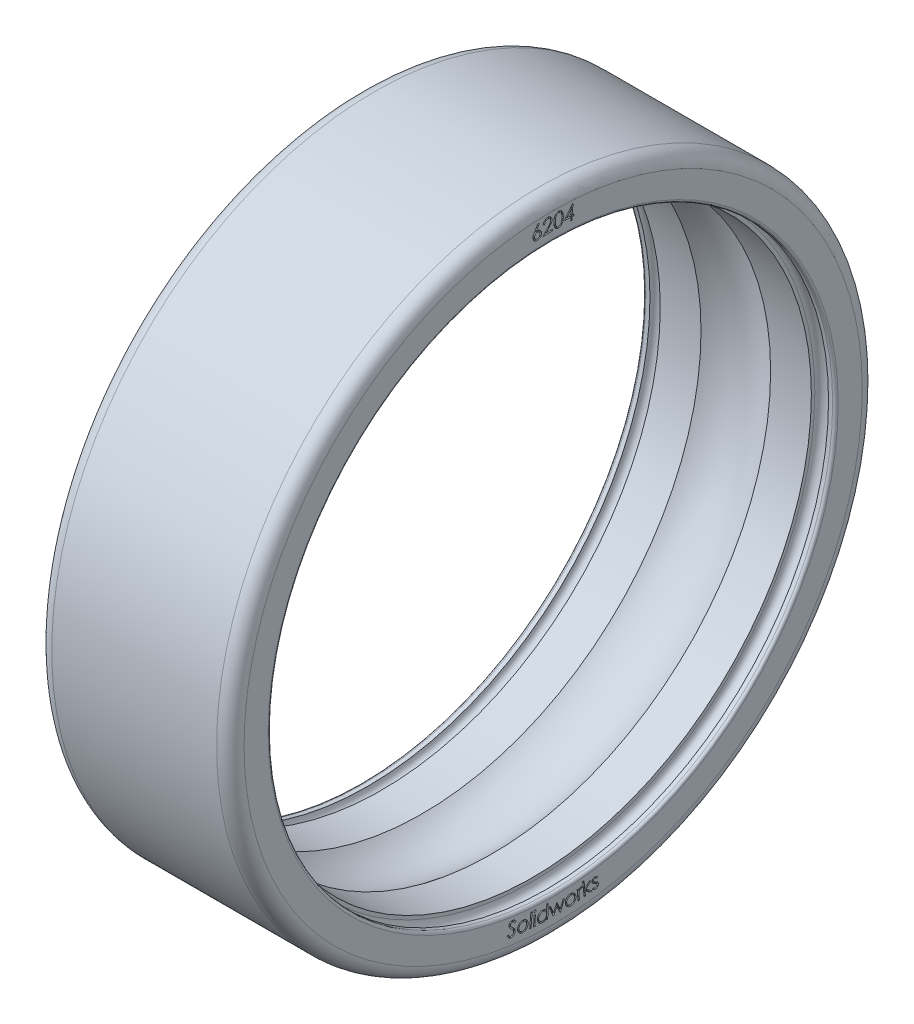
from build123d import *

# Parameters (mm, degrees)
CUT_EXTRUDE1_DEPTH = 0.1
CUT_EXTRUDE2_DEPTH = 0.1


with BuildPart() as part:
    # Sketch1 → Revolve1 (revolve)
    with BuildSketch(Plane.XY, mode=Mode.PRIVATE) as revolve1_sk:
        with BuildLine():
            Line((5.5, 20.295), (5.5, 20.546260715))
            ThreePointArc((5.5, 20.546260715), (6, 21.046260715), (6.5, 20.546260715))
            Line((6.5, 20.546260715), (6.8, 20.546260715))
            ThreePointArc((6.8, 20.546260715), (6.941421356, 20.604839359), (7, 20.746260715))
            Line((7, 20.746260715), (7, 22.5))
            ThreePointArc((7, 22.5), (6.707106781, 23.207106781), (6, 23.5))
            Line((6, 23.5), (-6, 23.5))
            ThreePointArc((-6, 23.5), (-6.707106781, 23.207106781), (-7, 22.5))
            Line((-7, 22.5), (-7, 20.746260715))
            ThreePointArc((-7, 20.746260715), (-6.941421356, 20.604839359), (-6.8, 20.546260715))
            Line((-6.8, 20.546260715), (-6.5, 20.546260715))
            ThreePointArc((-6.5, 20.546260715), (-6, 21.046260715), (-5.5, 20.546260715))
            Line((-5.5, 20.546260715), (-5.5, 20.295))
            Line((-5.5, 20.295), (-2.533964285, 20.295))
            ThreePointArc((-2.533964285, 20.295), (0, 21.2), (2.533964285, 20.295))
            Line((2.533964285, 20.295), (5.5, 20.295))
        make_face()
    revolve(revolve1_sk.sketch.rotate(Axis((0, 0, 0), (-1, 0, 0)), 90), axis=Axis((0, 0, 0), (-1, 0, 0)))

    # Sketch3 → Cut-Extrude1 (cut)
    # profile 1 of 15: a face of its own
    with BuildSketch(Plane(origin=(7, 0, 0), x_dir=(0, 0, -1), z_dir=(1, 0, 0))):
        with BuildLine():
            Line((-1.100852759, 22.248472496), (-1.015516221, 22.200595894))
            Line((-1.015516221, 22.200595894), (-1.256101157, 21.775115125))
            add(Edge.make_bspline(
                [(-1.256101157, 21.775115125), (-1.247464404, 21.778508876), (-1.230586583, 21.785140898), (-1.205172027, 21.792797654), (-1.180349237, 21.797931707), (-1.163972835, 21.79955792), (-1.1559409, 21.800355509)],
                knots=[0, 0, 0, 0, 1.073176148, 2.097185824, 3.066749925, 4, 4, 4, 4], degree=3))
            add(Edge.make_bspline(
                [(-1.1559409, 21.800355509), (-1.146259595, 21.800732177), (-1.127142427, 21.801475963), (-1.098779903, 21.799519992), (-1.071365795, 21.794374715), (-1.044902712, 21.78681556), (-1.019322749, 21.776526063), (-0.994913442, 21.763182591), (-0.971291852, 21.74723465), (-0.948921121, 21.72875876), (-0.928114231, 21.70824853), (-0.909705176, 21.686004277), (-0.893710163, 21.662438833), (-0.880400892, 21.637367017), (-0.86964716, 21.610891372), (-0.86111182, 21.583035242), (-0.855315174, 21.553755907), (-0.853417192, 21.533684466), (-0.852455324, 21.523512561)],
                knots=[0, 0, 0, 0, 1.015516343, 2.005287039, 2.973523166, 3.935332341, 4.887123599, 5.858367972, 6.846874704, 7.871618834, 8.896530408, 9.906018026, 10.894524758, 11.878108939, 12.876731691, 13.886777687, 14.929050623, 16, 16, 16, 16], degree=3))
            add(Edge.make_bspline(
                [(-0.852455324, 21.523512561), (-0.851964383, 21.509483547), (-0.851000496, 21.481939752), (-0.855701933, 21.44119043), (-0.865840403, 21.402292114), (-0.880828316, 21.365313147), (-0.90080849, 21.330931809), (-0.925142382, 21.299412836), (-0.954181489, 21.271363467), (-0.98707111, 21.246929945), (-1.022968525, 21.22650374), (-1.061150066, 21.211006845), (-1.101136321, 21.200258256), (-1.128635515, 21.197421006), (-1.142519426, 21.195988522)],
                knots=[0, 0, 0, 0, 1.034922707, 2.031910401, 3.014409203, 3.993590249, 4.967312186, 5.940223224, 6.922981526, 7.937164095, 8.956720139, 9.962438615, 10.971267233, 12, 12, 12, 12], degree=3))
            add(Edge.make_bspline(
                [(-1.142519426, 21.195988522), (-1.155951705, 21.195562325), (-1.182579794, 21.194717433), (-1.222130231, 21.199780647), (-1.260507218, 21.209630414), (-1.297372836, 21.224466021), (-1.331945608, 21.243960217), (-1.363335465, 21.268075944), (-1.391196604, 21.296418142), (-1.415320669, 21.328542659), (-1.435103118, 21.36375139), (-1.450111685, 21.400996194), (-1.460764189, 21.439789752), (-1.463471332, 21.466424627), (-1.464835131, 21.479842689)],
                knots=[0, 0, 0, 0, 1.010432082, 2.003075919, 2.989450109, 3.98641235, 4.985918754, 5.968249594, 6.956453876, 7.968884738, 8.983995262, 9.987500994, 10.986147412, 12, 12, 12, 12], degree=3))
            add(Edge.make_bspline(
                [(-1.464835131, 21.479842689), (-1.465238839, 21.490193771), (-1.466057772, 21.511191264), (-1.463465573, 21.543340596), (-1.45770638, 21.576316191), (-1.450808687, 21.604485457), (-1.4433965, 21.627749069), (-1.436504276, 21.646337471), (-1.428722048, 21.666017302), (-1.419704991, 21.686596712), (-1.409479159, 21.708039764), (-1.397934349, 21.730352272), (-1.385409169, 21.753676806), (-1.376458953, 21.769457061), (-1.371886413, 21.777518971)],
                knots=[0, 0, 0, 0, 1.177272683, 2.388134318, 3.659038593, 4.981443473, 5.682717306, 6.434665356, 7.235631296, 8.089192121, 8.98931583, 9.936879376, 10.945980744, 12, 12, 12, 12], degree=3))
            Line((-1.371886413, 21.777518971), (-1.100852759, 22.248472496))
        make_face()
        with BuildLine():
            add(Edge.make_bspline(
                [(-1.173769426, 21.711613522), (-1.180864989, 21.710944761), (-1.194822182, 21.709629287), (-1.215187409, 21.705403603), (-1.234546525, 21.699107177), (-1.253059932, 21.691055248), (-1.270707914, 21.681293857), (-1.287331139, 21.669495955), (-1.3029371, 21.655780874), (-1.317612646, 21.640556961), (-1.330821933, 21.624027115), (-1.342019771, 21.606499613), (-1.351537, 21.588455574), (-1.359024578, 21.569664512), (-1.364423039, 21.550180713), (-1.367844641, 21.529979581), (-1.369249308, 21.509104), (-1.368739319, 21.495000281), (-1.368480965, 21.487855509)],
                knots=[0, 0, 0, 0, 1.036341376, 2.038515843, 3.018550862, 3.993129798, 4.971622819, 5.947363121, 6.952640449, 7.990119536, 9.020295557, 10.025432053, 11.011802329, 11.984151438, 12.962306823, 13.947719829, 14.960339996, 16, 16, 16, 16], degree=3))
            add(Edge.make_bspline(
                [(-1.368480965, 21.487855509), (-1.367840935, 21.480753144), (-1.366580729, 21.466768709), (-1.361943546, 21.446507174), (-1.356054909, 21.427031866), (-1.347884687, 21.408583057), (-1.338206236, 21.390838612), (-1.326122747, 21.37442853), (-1.312673052, 21.358613491), (-1.297420294, 21.344006282), (-1.280826567, 21.330847357), (-1.263487195, 21.319330191), (-1.245257526, 21.310143579), (-1.226541561, 21.302588002), (-1.207046755, 21.297183962), (-1.18690386, 21.293876182), (-1.166179197, 21.292050842), (-1.152202928, 21.292776438), (-1.145123593, 21.293143971)],
                knots=[0, 0, 0, 0, 1.037591232, 2.042999437, 3.021271322, 3.997025627, 4.976698737, 5.959264589, 6.959389577, 7.998119892, 9.029538333, 10.041184524, 11.024279788, 11.997801576, 12.977136643, 13.963738084, 14.968581559, 16, 16, 16, 16], degree=3))
            add(Edge.make_bspline(
                [(-1.145123593, 21.293143971), (-1.138028758, 21.293814398), (-1.124072995, 21.295133149), (-1.103697385, 21.29933505), (-1.084401584, 21.305710862), (-1.065823662, 21.313402836), (-1.048260841, 21.323365341), (-1.031716618, 21.335227623), (-1.015887471, 21.348698849), (-1.001481021, 21.364072547), (-0.988306573, 21.380589633), (-0.976800961, 21.397939587), (-0.967611364, 21.416166521), (-0.960056572, 21.434883206), (-0.954652321, 21.454377818), (-0.951344598, 21.474520766), (-0.949519243, 21.495245415), (-0.950244841, 21.509221686), (-0.950612375, 21.516301022)],
                knots=[0, 0, 0, 0, 1.038253639, 2.042277324, 3.024120708, 3.996658229, 4.968464976, 5.959574636, 6.960338112, 7.993011423, 9.025088331, 10.037380365, 11.021103246, 11.995246538, 12.975206821, 13.962438117, 14.967923093, 16, 16, 16, 16], degree=3))
            add(Edge.make_bspline(
                [(-0.950612375, 21.516301022), (-0.951286366, 21.523395284), (-0.952618314, 21.53741504), (-0.956805416, 21.557924227), (-0.963148429, 21.577364109), (-0.970874281, 21.596107538), (-0.981046032, 21.61359942), (-0.992648797, 21.630448046), (-1.006395274, 21.646060286), (-1.021728374, 21.660551286), (-1.038249724, 21.673740283), (-1.05563004, 21.685120382), (-1.073616388, 21.694710735), (-1.092363398, 21.702151743), (-1.111844205, 21.707557864), (-1.131980489, 21.710962372), (-1.152720719, 21.71238462), (-1.166691295, 21.711872822), (-1.173769426, 21.711613522)],
                knots=[0, 0, 0, 0, 1.036456902, 2.048257414, 3.037651921, 4.008506429, 4.991871779, 5.975669009, 6.9810584, 8.011944631, 9.04223549, 10.052775714, 11.030654083, 12.003111584, 12.981376008, 13.966898863, 14.969938222, 16, 16, 16, 16], degree=3))
        make_face(mode=Mode.SUBTRACT)
    # profile 2 of 15: a face of its own
    with BuildSketch(Plane(origin=(7, 0, 0), x_dir=(0, 0, -1), z_dir=(1, 0, 0))):
        with BuildLine():
            Line((-0.623309863, 21.921922481), (-0.718662427, 21.920119597))
            add(Edge.make_bspline(
                [(-0.718662427, 21.920119597), (-0.718267591, 21.932153386), (-0.717490412, 21.955840194), (-0.71281361, 21.99050325), (-0.705406406, 22.023558475), (-0.695231781, 22.055022195), (-0.68183967, 22.084808576), (-0.665871798, 22.113136582), (-0.646857333, 22.139720889), (-0.625305751, 22.164457553), (-0.601585107, 22.186938582), (-0.576290568, 22.206979953), (-0.54932318, 22.223844215), (-0.520983352, 22.237720605), (-0.491230806, 22.24861207), (-0.46004531, 22.256651648), (-0.427350755, 22.261681939), (-0.405044311, 22.262735061), (-0.393742555, 22.263268635)],
                knots=[0, 0, 0, 0, 1.097232159, 2.159745822, 3.183294088, 4.182507938, 5.169085407, 6.156057278, 7.142634747, 8.14375714, 9.142841151, 10.118405616, 11.081254303, 12.036954793, 12.990383755, 13.964959882, 14.968929057, 16, 16, 16, 16], degree=3))
            add(Edge.make_bspline(
                [(-0.393742555, 22.263268635), (-0.38258468, 22.263182502), (-0.360679535, 22.263013405), (-0.328578365, 22.259687571), (-0.298074483, 22.253174058), (-0.269147534, 22.24406649), (-0.24192196, 22.231827696), (-0.216047461, 22.217255273), (-0.19194844, 22.19945316), (-0.169705398, 22.179139217), (-0.149643807, 22.156929466), (-0.131580604, 22.133742767), (-0.116627535, 22.109179873), (-0.104027645, 22.083755533), (-0.094139489, 22.057253661), (-0.087251529, 22.029548935), (-0.082405481, 22.000946053), (-0.081632348, 21.98143759), (-0.081242555, 21.971601968)],
                knots=[0, 0, 0, 0, 1.121556983, 2.201841044, 3.238167977, 4.253112813, 5.244988983, 6.23431686, 7.233415498, 8.250489963, 9.258079868, 10.239723173, 11.201230445, 12.144061298, 13.08939889, 14.03875724, 15.011196246, 16, 16, 16, 16], degree=3))
            add(Edge.make_bspline(
                [(-0.081242555, 21.971601968), (-0.081485959, 21.957686391), (-0.081968846, 21.930079363), (-0.089008436, 21.889243261), (-0.101174481, 21.849727715), (-0.115441373, 21.817611362), (-0.130263183, 21.791879555), (-0.14351095, 21.770601186), (-0.15907321, 21.747625069), (-0.177357579, 21.723157055), (-0.197590994, 21.696746942), (-0.220633051, 21.668978493), (-0.245626928, 21.639231063), (-0.263359444, 21.619069278), (-0.272548645, 21.608621199)],
                knots=[0, 0, 0, 0, 1.18867687, 2.358208706, 3.528520713, 4.716923315, 5.353571844, 6.066499105, 6.859866228, 7.725446032, 8.677880943, 9.704264835, 10.810322589, 12, 12, 12, 12], degree=3))
            Line((-0.272548645, 21.608621199), (-0.514736145, 21.336986584))
            Line((-0.514736145, 21.336986584), (-0.05560153, 21.345600366))
            Line((-0.05560153, 21.345600366), (-0.053798645, 21.24964684))
            Line((-0.053798645, 21.24964684), (-0.729279414, 21.236826327))
            Line((-0.729279414, 21.236826327), (-0.357083901, 21.654494597))
            add(Edge.make_bspline(
                [(-0.357083901, 21.654494597), (-0.348042674, 21.664620553), (-0.33064649, 21.684103861), (-0.306070645, 21.712484426), (-0.283882606, 21.738795879), (-0.264342341, 21.763130287), (-0.247199926, 21.785409054), (-0.232638334, 21.805627083), (-0.22018227, 21.823615432), (-0.207528287, 21.845035164), (-0.194996026, 21.870876457), (-0.184856139, 21.902575638), (-0.178389139, 21.934876582), (-0.178128052, 21.95668116), (-0.177997363, 21.967595558)],
                knots=[0, 0, 0, 0, 1.321138739, 2.541997057, 3.653640628, 4.67058603, 5.579138316, 6.388992269, 7.095550707, 7.707422382, 8.809086612, 9.881850713, 10.939749004, 12, 12, 12, 12], degree=3))
            add(Edge.make_bspline(
                [(-0.177997363, 21.967595558), (-0.178341919, 21.974482708), (-0.179021176, 21.988060009), (-0.182157592, 22.00806176), (-0.187766132, 22.02708404), (-0.194684304, 22.04560087), (-0.203967602, 22.063135912), (-0.215132375, 22.079955258), (-0.228182267, 22.096020482), (-0.243091426, 22.111015669), (-0.25923217, 22.124855437), (-0.276453373, 22.136912224), (-0.29462235, 22.14694842), (-0.313496031, 22.155247597), (-0.333243537, 22.161487553), (-0.353863356, 22.165642724), (-0.375317791, 22.168115047), (-0.38992977, 22.168248803), (-0.397348325, 22.168316712)],
                knots=[0, 0, 0, 0, 1.000536802, 1.972454376, 2.929618882, 3.874536866, 4.836888233, 5.801871243, 6.800857881, 7.835682334, 8.866915294, 9.883193413, 10.881004081, 11.874900548, 12.871062524, 13.880338621, 14.923840242, 16, 16, 16, 16], degree=3))
            add(Edge.make_bspline(
                [(-0.397348325, 22.168316712), (-0.4051058, 22.167993802), (-0.420425285, 22.167356117), (-0.442843585, 22.163918046), (-0.464148089, 22.15847185), (-0.484494142, 22.151270317), (-0.503662467, 22.141739874), (-0.522029786, 22.130576632), (-0.539138178, 22.117173753), (-0.555155114, 22.101993044), (-0.569724492, 22.085013357), (-0.582700963, 22.066368216), (-0.59385494, 22.046143414), (-0.603351509, 22.024358905), (-0.610884979, 22.000976617), (-0.616928979, 21.976083219), (-0.621110408, 21.949543587), (-0.622564443, 21.931283585), (-0.623309863, 21.921922481)],
                knots=[0, 0, 0, 0, 1.000659817, 1.976105887, 2.917985763, 3.8331552, 4.753535407, 5.673593325, 6.600235786, 7.550384284, 8.515168586, 9.480183412, 10.474599729, 11.488801488, 12.539873085, 13.63840583, 14.78931401, 16, 16, 16, 16], degree=3))
        make_face()
    # profile 3 of 15: a face of its own
    with BuildSketch(Plane(origin=(7, 0, 0), x_dir=(0, 0, -1), z_dir=(1, 0, 0))):
        with BuildLine():
            add(Edge.make_bspline(
                [(0.058342456, 21.745592946), (0.05889517, 21.761491008), (0.059971435, 21.792448302), (0.063442148, 21.837405934), (0.067987436, 21.879571759), (0.07375608, 21.918873564), (0.080715817, 21.955382352), (0.088864463, 21.989033321), (0.098207935, 22.019933776), (0.109170287, 22.048074795), (0.120978473, 22.074148319), (0.134088812, 22.098237628), (0.14810791, 22.120735194), (0.163085326, 22.141616327), (0.179198447, 22.160733869), (0.196271348, 22.178206662), (0.214295255, 22.194179449), (0.233602006, 22.20813313), (0.253609994, 22.220469601), (0.274021683, 22.231488094), (0.295237123, 22.240212387), (0.316824288, 22.247513299), (0.338965617, 22.252837851), (0.3614934, 22.256803474), (0.384636544, 22.258528491), (0.400221178, 22.258452092), (0.408102071, 22.258413459)],
                knots=[0, 0, 0, 0, 1.640181228, 3.193821509, 4.648410987, 6.012649851, 7.288762204, 8.479466079, 9.581524137, 10.614707689, 11.591421741, 12.531101786, 13.440501687, 14.323370098, 15.178524332, 16.016004768, 16.840563474, 17.658628241, 18.46877306, 19.26343786, 20.04732063, 20.83117316, 21.611054028, 22.393241522, 23.187488595, 24, 24, 24, 24], degree=3))
            add(Edge.make_bspline(
                [(0.408102071, 22.258413459), (0.416061161, 22.258016436), (0.431843904, 22.257229147), (0.455120612, 22.253646711), (0.47780931, 22.248786576), (0.499772963, 22.241783624), (0.52122929, 22.233510763), (0.542001306, 22.223119695), (0.56215998, 22.211147928), (0.581705413, 22.197490386), (0.600277502, 22.182032157), (0.618032795, 22.165018019), (0.6343962, 22.146038159), (0.649985355, 22.12551331), (0.664250415, 22.103136532), (0.677559154, 22.079118258), (0.689794265, 22.053453713), (0.700816882, 22.025884282), (0.71065955, 21.99634335), (0.719145718, 21.964524003), (0.725746119, 21.930359936), (0.731273288, 21.893885082), (0.734902246, 21.855090876), (0.737358489, 21.813936378), (0.738099682, 21.770431336), (0.737524163, 21.740650834), (0.737228674, 21.725360574)],
                knots=[0, 0, 0, 0, 0.815828704, 1.617774871, 2.409415347, 3.190434486, 3.976707846, 4.76289194, 5.566470094, 6.376774325, 7.202663582, 8.039555239, 8.892807878, 9.766997859, 10.677755273, 11.608559094, 12.578454456, 13.588268293, 14.648178132, 15.766472339, 16.959054217, 18.210841162, 19.544201395, 20.948855831, 22.433445205, 24, 24, 24, 24], degree=3))
            add(Edge.make_bspline(
                [(0.737228674, 21.725360574), (0.736673116, 21.710130347), (0.735592546, 21.680507295), (0.732149691, 21.637273808), (0.727360808, 21.596519588), (0.72142985, 21.558133051), (0.714068325, 21.522213866), (0.705228274, 21.488734796), (0.695317043, 21.457567248), (0.683863481, 21.42881477), (0.671087878, 21.402219183), (0.657539465, 21.377350687), (0.642911305, 21.354241905), (0.627206054, 21.332924764), (0.610620802, 21.313237558), (0.592880135, 21.295273821), (0.57408872, 21.279110031), (0.554421183, 21.264604087), (0.533994411, 21.252057804), (0.513082175, 21.241104604), (0.491524688, 21.232144804), (0.469562764, 21.224597291), (0.446983481, 21.219330044), (0.424060414, 21.215348883), (0.400583896, 21.213631924), (0.384799601, 21.213705126), (0.376852071, 21.213741984)],
                knots=[0, 0, 0, 0, 1.562234339, 3.038572545, 4.444649437, 5.768135804, 7.019351698, 8.201533421, 9.316396956, 10.370176739, 11.371397532, 12.339472549, 13.271895148, 14.172777249, 15.051888512, 15.908648575, 16.758048209, 17.590480149, 18.41114858, 19.213308414, 20.007896933, 20.80233801, 21.590977576, 22.382108713, 23.185377672, 24, 24, 24, 24], degree=3))
            add(Edge.make_bspline(
                [(0.376852071, 21.213741984), (0.36903048, 21.214166724), (0.353465029, 21.215011982), (0.330471611, 21.218203656), (0.3081804, 21.223239063), (0.286579735, 21.229948109), (0.265534179, 21.23805649), (0.245190285, 21.248178537), (0.225557739, 21.260058649), (0.206525302, 21.273483829), (0.188214151, 21.288444827), (0.171204223, 21.30535624), (0.155338818, 21.32390026), (0.140490335, 21.343991685), (0.126672418, 21.365695175), (0.113824387, 21.388944802), (0.102179198, 21.413906352), (0.091723907, 21.440728742), (0.082437066, 21.46973354), (0.074722895, 21.501270575), (0.068249548, 21.535426834), (0.063681901, 21.57230936), (0.059918191, 21.61184637), (0.058177837, 21.654095695), (0.057178555, 21.69898567), (0.057947265, 21.729767926), (0.058342456, 21.745592946)],
                knots=[0, 0, 0, 0, 0.808724647, 1.60941208, 2.394050842, 3.166226471, 3.943558179, 4.720736926, 5.509576739, 6.31124357, 7.124454243, 7.948556811, 8.784803617, 9.64269305, 10.526494372, 11.440113667, 12.384145743, 13.36893322, 14.41140442, 15.526992381, 16.719913647, 17.999539726, 19.363725541, 20.820430529, 22.365397532, 24, 24, 24, 24], degree=3))
        make_face()
        with BuildLine():
            add(Edge.make_bspline(
                [(0.152493097, 21.740785254), (0.15212678, 21.727163998), (0.151417538, 21.700791259), (0.152008495, 21.662453311), (0.152949255, 21.62669634), (0.155548828, 21.593447877), (0.158462937, 21.562724813), (0.163047638, 21.534561265), (0.168014387, 21.508868503), (0.174511126, 21.485604334), (0.182080901, 21.464341242), (0.190246189, 21.444424961), (0.199389888, 21.425758277), (0.209791581, 21.40849818), (0.220579382, 21.392197348), (0.232858559, 21.377494666), (0.245749274, 21.363868242), (0.264035466, 21.347790658), (0.288090513, 21.33090433), (0.318715891, 21.315765307), (0.350527626, 21.306179205), (0.372250179, 21.304380722), (0.383062007, 21.303485574)],
                knots=[0, 0, 0, 0, 1.479143874, 2.863838341, 4.162193936, 5.361489553, 6.483892805, 7.511250997, 8.458112141, 9.323456516, 10.130510392, 10.907303839, 11.659452694, 12.384275129, 13.094041624, 13.779053645, 14.460990056, 15.12863554, 16.419745915, 17.63877326, 18.824761562, 20, 20, 20, 20], degree=3))
            add(Edge.make_bspline(
                [(0.383062007, 21.303485574), (0.393986198, 21.303697732), (0.415754351, 21.304120489), (0.447874087, 21.311745517), (0.478946589, 21.324603609), (0.503620288, 21.339639494), (0.52227606, 21.354500947), (0.536061708, 21.366834505), (0.54862997, 21.381010018), (0.560417851, 21.396448502), (0.57155739, 21.413191897), (0.581680542, 21.431363728), (0.590975412, 21.451002582), (0.596413548, 21.46471098), (0.59920784, 21.471754805)],
                knots=[0, 0, 0, 0, 1.338388866, 2.66694855, 4.023494684, 5.454876309, 6.196238968, 6.950677972, 7.722773498, 8.518068989, 9.33438472, 10.189624847, 11.069769744, 12, 12, 12, 12], degree=3))
            add(Edge.make_bspline(
                [(0.59920784, 21.471754805), (0.602438587, 21.480671462), (0.609038351, 21.498886398), (0.61733948, 21.527257208), (0.624552739, 21.557083805), (0.630744633, 21.58821988), (0.635761669, 21.62076852), (0.639476544, 21.654662673), (0.642332596, 21.689934039), (0.643357413, 21.713937686), (0.643879315, 21.726161856)],
                knots=[0, 0, 0, 0, 0.877099717, 1.791737987, 2.732530495, 3.714921479, 4.727376199, 5.777798706, 6.868315081, 8, 8, 8, 8], degree=3))
            add(Edge.make_bspline(
                [(0.643879315, 21.726161856), (0.644169498, 21.738380838), (0.644737183, 21.762284784), (0.644057727, 21.797293567), (0.642480603, 21.830628817), (0.639973271, 21.862319439), (0.636125865, 21.8923145), (0.63141449, 21.9206882), (0.625358474, 21.947344306), (0.618402872, 21.972438686), (0.610359594, 21.995883433), (0.601580444, 22.017773109), (0.591959794, 22.038050814), (0.58158131, 22.056805692), (0.570138618, 22.073857442), (0.557831817, 22.089348626), (0.544929008, 22.103457605), (0.52658149, 22.119481835), (0.50262827, 22.136235943), (0.47236194, 22.151281134), (0.440937464, 22.161071512), (0.419454208, 22.162664389), (0.408703033, 22.163461536)],
                knots=[0, 0, 0, 0, 1.327889183, 2.597744519, 3.803513845, 4.953717014, 6.050700288, 7.088403992, 8.077595565, 9.019381818, 9.916484044, 10.769307768, 11.580631617, 12.353681846, 13.09620274, 13.808917989, 14.501974792, 15.170167186, 16.452233744, 17.665748898, 18.831837123, 20, 20, 20, 20], degree=3))
            add(Edge.make_bspline(
                [(0.408703033, 22.163461536), (0.397774399, 22.163265459), (0.375917132, 22.162873304), (0.343642892, 22.154925669), (0.312131337, 22.142015191), (0.287337221, 22.126470417), (0.268223087, 22.111731675), (0.254564713, 22.099041707), (0.241791081, 22.084971478), (0.229620696, 22.069659247), (0.218553543, 22.052906032), (0.208223847, 22.034820762), (0.198650658, 22.015520094), (0.189950813, 21.994579949), (0.182019935, 21.971748623), (0.175345435, 21.946402256), (0.169351483, 21.918525195), (0.164213769, 21.888039774), (0.159755722, 21.85491134), (0.156516046, 21.819146935), (0.153800328, 21.780815423), (0.152938079, 21.754411525), (0.152493097, 21.740785254)],
                knots=[0, 0, 0, 0, 1.183466652, 2.366933305, 3.582623176, 4.868258342, 5.529513513, 6.201529839, 6.889123939, 7.591090166, 8.322965525, 9.066594951, 9.851182641, 10.660337379, 11.526947053, 12.473054024, 13.503935493, 14.62186223, 15.828613723, 17.132111427, 18.519967428, 20, 20, 20, 20], degree=3))
        make_face(mode=Mode.SUBTRACT)
    # profile 4 of 15: a face of its own
    with BuildSketch(Plane(origin=(7, 0, 0), x_dir=(0, 0, -1), z_dir=(1, 0, 0))):
        Polygon((1.416834571, 22.221679813), (1.437066943, 22.22047789), (1.39700284, 21.527368915), (1.517395468, 21.520558018), (1.511986814, 21.425205454), (1.391594186, 21.432016351), (1.378172712, 21.200846479), (1.278813737, 21.206655774), (1.292235212, 21.437825646), (0.817074955, 21.465269556), align=None)
        Polygon((1.297643866, 21.53317821), (1.321482007, 21.947641351), (1.004975596, 21.550005133), align=None, mode=Mode.SUBTRACT)
    # profile 5 of 15: a face of its own
    with BuildSketch(Plane(origin=(7, 0, 0), x_dir=(0, 0, -1), z_dir=(1, 0, 0))):
        with BuildLine():
            Line((-3.348636804, -21.556141005), (-3.258492573, -21.516477544))
            add(Edge.make_bspline(
                [(-3.258492573, -21.516477544), (-3.252865734, -21.530281138), (-3.24209354, -21.55670716), (-3.222666664, -21.592881479), (-3.202286575, -21.624474817), (-3.179818892, -21.650748953), (-3.156194001, -21.672496801), (-3.130537822, -21.688632302), (-3.103551636, -21.700470752), (-3.084517828, -21.703876758), (-3.074998983, -21.705580108)],
                knots=[0, 0, 0, 0, 1.291856341, 2.4731692, 3.555667658, 4.545547092, 5.464070191, 6.328348012, 7.164003499, 8, 8, 8, 8], degree=3))
            add(Edge.make_bspline(
                [(-3.074998983, -21.705580108), (-3.066794062, -21.7063036), (-3.050524754, -21.707738192), (-3.0260549, -21.7065446), (-3.00209125, -21.701964571), (-2.978751457, -21.69491566), (-2.956853473, -21.68490683), (-2.936859521, -21.672694), (-2.919132842, -21.658158432), (-2.904240887, -21.641195414), (-2.891519828, -21.622923527), (-2.881943341, -21.603198811), (-2.87461632, -21.5827404), (-2.872387566, -21.568480408), (-2.871273022, -21.561349339)],
                knots=[0, 0, 0, 0, 1.067238961, 2.116198049, 3.164012999, 4.223921258, 5.270125148, 6.276964933, 7.254756039, 8.229783065, 9.195228802, 10.132302988, 11.066011005, 12, 12, 12, 12], degree=3))
            add(Edge.make_bspline(
                [(-2.871273022, -21.561349339), (-2.87066295, -21.553001006), (-2.869434079, -21.536184903), (-2.872687032, -21.510571854), (-2.880154876, -21.484816757), (-2.888175251, -21.468428839), (-2.892306676, -21.459987159)],
                knots=[0, 0, 0, 0, 0.953510772, 1.920663048, 2.928900067, 4, 4, 4, 4], degree=3))
            add(Edge.make_bspline(
                [(-2.892306676, -21.459987159), (-2.895773415, -21.453800413), (-2.903061901, -21.440793377), (-2.916045533, -21.421224772), (-2.931027008, -21.400348365), (-2.948581404, -21.378508545), (-2.968459893, -21.355613341), (-2.990244537, -21.331259135), (-3.014585931, -21.306026891), (-3.031823327, -21.289073518), (-3.040744176, -21.280299659)],
                knots=[0, 0, 0, 0, 0.727482251, 1.529461131, 2.408011697, 3.363581575, 4.403290802, 5.519140714, 6.716083984, 8, 8, 8, 8], degree=3))
            add(Edge.make_bspline(
                [(-3.040744176, -21.280299659), (-3.04957815, -21.271572318), (-3.066473769, -21.254880643), (-3.090315658, -21.23070499), (-3.111444319, -21.208419542), (-3.129797558, -21.188100122), (-3.145500197, -21.169802916), (-3.15866217, -21.153651602), (-3.168916798, -21.139292876), (-3.17446954, -21.130154853), (-3.176962124, -21.126052864)],
                knots=[0, 0, 0, 0, 1.444925578, 2.763525094, 3.950681197, 5.017927165, 5.949151688, 6.756074135, 7.441611132, 8, 8, 8, 8], degree=3))
            add(Edge.make_bspline(
                [(-3.176962124, -21.126052864), (-3.18038533, -21.119685826), (-3.187122475, -21.107154981), (-3.195670909, -21.087795455), (-3.202170906, -21.068167834), (-3.207297916, -21.048516562), (-3.210494174, -21.0286584), (-3.212052799, -21.008700823), (-3.212201634, -20.988516117), (-3.210747254, -20.975136792), (-3.210015009, -20.968400621)],
                knots=[0, 0, 0, 0, 1.057825274, 2.081885334, 3.092473111, 4.080891569, 5.051318221, 6.031732374, 7.00902418, 8, 8, 8, 8], degree=3))
            add(Edge.make_bspline(
                [(-3.210015009, -20.968400621), (-3.208291559, -20.957919873), (-3.204900752, -20.937299498), (-3.195049952, -20.907809777), (-3.181745195, -20.880205979), (-3.164690931, -20.854838281), (-3.144479863, -20.831917803), (-3.121225738, -20.812171701), (-3.095309343, -20.795535585), (-3.06686443, -20.782517748), (-3.036806667, -20.772546435), (-3.005444291, -20.767103), (-2.973404609, -20.76502247), (-2.951993989, -20.767054328), (-2.941184881, -20.768080108)],
                knots=[0, 0, 0, 0, 1.021366019, 2.00948921, 2.981415329, 3.963958822, 4.943194113, 5.914630998, 6.891985966, 7.898758546, 8.919436299, 9.932124559, 10.956037176, 12, 12, 12, 12], degree=3))
            add(Edge.make_bspline(
                [(-2.941184881, -20.768080108), (-2.929766814, -20.769988511), (-2.907172926, -20.773764829), (-2.874515093, -20.784609476), (-2.84375889, -20.7997873), (-2.819516083, -20.815724889), (-2.800915445, -20.830871131), (-2.786815831, -20.844157695), (-2.772901447, -20.859521382), (-2.758614592, -20.876374606), (-2.744885574, -20.895462905), (-2.730830962, -20.916042233), (-2.716751876, -20.938538481), (-2.707813761, -20.954407305), (-2.703204112, -20.962591326)],
                knots=[0, 0, 0, 0, 1.298792382, 2.570029465, 3.847974505, 5.141820246, 5.818854901, 6.540411517, 7.315342496, 8.145977484, 9.020518715, 9.954526806, 10.94508907, 12, 12, 12, 12], degree=3))
            Line((-2.703204112, -20.962591326), (-2.791545458, -21.013272416))
            add(Edge.make_bspline(
                [(-2.791545458, -21.013272416), (-2.795312948, -21.006772247), (-2.802555457, -20.994276519), (-2.813678426, -20.976528364), (-2.824367793, -20.960382435), (-2.834835746, -20.945913122), (-2.844838207, -20.933012687), (-2.854558314, -20.921727215), (-2.864291979, -20.912320979), (-2.876364728, -20.901664334), (-2.892192943, -20.890868713), (-2.912351728, -20.880815276), (-2.933769902, -20.873395818), (-2.948681016, -20.870901745), (-2.956208919, -20.869642608)],
                knots=[0, 0, 0, 0, 1.187423074, 2.282666428, 3.310110945, 4.247470885, 5.10463358, 5.889978068, 6.598993365, 7.242363342, 8.433860081, 9.613849043, 10.795347425, 12, 12, 12, 12], degree=3))
            add(Edge.make_bspline(
                [(-2.956208919, -20.869642608), (-2.965825663, -20.868790365), (-2.984328845, -20.867150599), (-3.011479607, -20.871018981), (-3.03647228, -20.879377635), (-3.058751832, -20.892712587), (-3.07757515, -20.909752147), (-3.092630097, -20.92967635), (-3.102934862, -20.952654108), (-3.105923928, -20.969175391), (-3.107450906, -20.977615364)],
                knots=[0, 0, 0, 0, 1.113079678, 2.141630959, 3.145101507, 4.142136048, 5.120583553, 6.064046334, 7.011009097, 8, 8, 8, 8], degree=3))
            add(Edge.make_bspline(
                [(-3.107450906, -20.977615364), (-3.107959242, -20.982951265), (-3.108974649, -20.993609785), (-3.108562999, -21.009746971), (-3.10624416, -21.025825344), (-3.102539757, -21.042186018), (-3.096051142, -21.058879766), (-3.087114652, -21.076335461), (-3.075634215, -21.094813867), (-3.066548077, -21.107022897), (-3.061777829, -21.113432672)],
                knots=[0, 0, 0, 0, 0.87173235, 1.741294858, 2.618764794, 3.512236107, 4.464806504, 5.524185129, 6.70019026, 8, 8, 8, 8], degree=3))
            add(Edge.make_bspline(
                [(-3.061777829, -21.113432672), (-3.059914522, -21.115574995), (-3.055445412, -21.12071332), (-3.047501, -21.129461878), (-3.036920398, -21.140390337), (-3.023690534, -21.15347023), (-3.00821162, -21.169109208), (-2.990008611, -21.186762834), (-2.969455646, -21.206810969), (-2.954755156, -21.220820259), (-2.946994176, -21.228216326)],
                knots=[0, 0, 0, 0, 0.41965498, 1.006534962, 1.746415027, 2.66761115, 3.756297477, 4.998594902, 6.415437572, 8, 8, 8, 8], degree=3))
            add(Edge.make_bspline(
                [(-2.946994176, -21.228216326), (-2.937741457, -21.237258949), (-2.919775509, -21.254816954), (-2.8943186, -21.280938534), (-2.871462582, -21.306246958), (-2.850880589, -21.330462994), (-2.832966199, -21.353886168), (-2.817081675, -21.376079498), (-2.804111119, -21.397621097), (-2.789819776, -21.424314692), (-2.776574436, -21.457165088), (-2.766106332, -21.49628624), (-2.761422743, -21.535047741), (-2.763482812, -21.56041536), (-2.764502188, -21.572967928)],
                knots=[0, 0, 0, 0, 1.149952556, 2.23285588, 3.241345014, 4.18062119, 5.056716667, 5.861910982, 6.604968975, 7.289960031, 8.551919014, 9.742463383, 10.882911147, 12, 12, 12, 12], degree=3))
            add(Edge.make_bspline(
                [(-2.764502188, -21.572967928), (-2.765825559, -21.581761241), (-2.768433658, -21.599091104), (-2.775998099, -21.624082513), (-2.785246582, -21.648107721), (-2.797436115, -21.670799023), (-2.811849463, -21.692342698), (-2.828926995, -21.712472851), (-2.848194364, -21.731552326), (-2.869640243, -21.749201574), (-2.892683708, -21.764929311), (-2.916820017, -21.778245235), (-2.941728434, -21.78887981), (-2.967408866, -21.797012571), (-2.993935406, -21.802401464), (-3.021238214, -21.805163141), (-3.049355151, -21.805455263), (-3.068198939, -21.803521076), (-3.07780347, -21.802535236)],
                knots=[0, 0, 0, 0, 0.988490185, 1.948116825, 2.899012309, 3.849878749, 4.808382328, 5.778997418, 6.782764078, 7.822852431, 8.865910501, 9.883748258, 10.885972949, 11.875552164, 12.876894663, 13.892994382, 14.926075643, 16, 16, 16, 16], degree=3))
            add(Edge.make_bspline(
                [(-3.07780347, -21.802535236), (-3.085168048, -21.801438136), (-3.099792727, -21.7992595), (-3.121200727, -21.794174896), (-3.141956189, -21.787862578), (-3.161785606, -21.779659931), (-3.181188629, -21.770545754), (-3.19968968, -21.759637396), (-3.217708689, -21.747660368), (-3.234750188, -21.733867526), (-3.25142139, -21.718599351), (-3.267088647, -21.70106352), (-3.282437575, -21.681843248), (-3.296794262, -21.660403733), (-3.310777986, -21.637215813), (-3.324325723, -21.61209231), (-3.336787378, -21.58480473), (-3.344623855, -21.565848316), (-3.348636804, -21.556141005)],
                knots=[0, 0, 0, 0, 0.923777556, 1.834450158, 2.728337009, 3.61326546, 4.495512008, 5.386782449, 6.276355819, 7.178503287, 8.105101998, 9.079044962, 10.09381228, 11.15580921, 12.278669465, 13.454070064, 14.696265406, 16, 16, 16, 16], degree=3))
        make_face()
    # profile 6 of 15: a face of its own
    with BuildSketch(Plane(origin=(7, 0, 0), x_dir=(0, 0, -1), z_dir=(1, 0, 0))):
        with BuildLine():
            add(Edge.make_bspline(
                [(-2.171761408, -21.135301075), (-2.158088716, -21.137158562), (-2.131214974, -21.140809463), (-2.092348991, -21.150993977), (-2.055646049, -21.164692989), (-2.020998779, -21.181789366), (-1.989001746, -21.203214647), (-1.958900947, -21.227713207), (-1.93113593, -21.256061414), (-1.91481041, -21.277221771), (-1.906537049, -21.287945305)],
                knots=[0, 0, 0, 0, 1.048474691, 2.060782197, 3.047280464, 4.023691787, 4.991164122, 5.968960659, 6.970720608, 8, 8, 8, 8], degree=3))
            add(Edge.make_bspline(
                [(-1.906537049, -21.287945305), (-1.899522101, -21.298168237), (-1.885690928, -21.318324501), (-1.868670209, -21.350484325), (-1.85475166, -21.383451725), (-1.844033767, -21.417435478), (-1.836871518, -21.452422582), (-1.832898086, -21.488285575), (-1.831911966, -21.525049088), (-1.834110568, -21.549707969), (-1.835222946, -21.562184087)],
                knots=[0, 0, 0, 0, 1.025010187, 2.020983595, 3.003864404, 3.982279707, 4.963840097, 5.953327412, 6.964489525, 8, 8, 8, 8], degree=3))
            add(Edge.make_bspline(
                [(-1.835222946, -21.562184087), (-1.836911269, -21.574715774), (-1.840237637, -21.599405969), (-1.849480079, -21.635339263), (-1.861709643, -21.669655796), (-1.876980338, -21.702612627), (-1.895678885, -21.733815912), (-1.917500614, -21.763566674), (-1.942646317, -21.791540865), (-1.970495752, -21.817845987), (-2.000560173, -21.841600097), (-2.032734873, -21.861562266), (-2.066320862, -21.877940565), (-2.101546008, -21.890394722), (-2.138237465, -21.898963393), (-2.176335225, -21.904067613), (-2.215954882, -21.905026893), (-2.242686268, -21.902840545), (-2.256296664, -21.901727357)],
                knots=[0, 0, 0, 0, 1.006200801, 1.982438182, 2.947798129, 3.904080338, 4.869777027, 5.839680419, 6.83762862, 7.860742948, 8.88718175, 9.883102247, 10.870011251, 11.85719237, 12.851564498, 13.865267679, 14.91309221, 16, 16, 16, 16], degree=3))
            add(Edge.make_bspline(
                [(-2.256296664, -21.901727357), (-2.269895874, -21.899837682), (-2.296591527, -21.896128194), (-2.335198176, -21.886447618), (-2.371517321, -21.873385878), (-2.405549154, -21.856947248), (-2.437139331, -21.836982485), (-2.466432675, -21.813760097), (-2.493397068, -21.787136742), (-2.517742523, -21.757498547), (-2.539280867, -21.725811959), (-2.557491775, -21.692919327), (-2.572597374, -21.659293117), (-2.583690473, -21.62464005), (-2.591886364, -21.58928653), (-2.596251784, -21.552965995), (-2.597079128, -21.515859588), (-2.595057103, -21.490994058), (-2.594037049, -21.478450113)],
                knots=[0, 0, 0, 0, 1.091240503, 2.14213764, 3.15834732, 4.15579373, 5.141367471, 6.124076166, 7.122864417, 8.148808063, 9.169447502, 10.165366255, 11.135295547, 12.095803927, 13.054196389, 14.017108902, 14.999688474, 16, 16, 16, 16], degree=3))
            add(Edge.make_bspline(
                [(-2.594037049, -21.478450113), (-2.592390908, -21.466058565), (-2.58914225, -21.441603866), (-2.580441147, -21.405961357), (-2.568525762, -21.372028135), (-2.553892215, -21.339587089), (-2.53623882, -21.308811914), (-2.515339391, -21.279839268), (-2.491765282, -21.252186402), (-2.473881451, -21.235495335), (-2.464830318, -21.227047869)],
                knots=[0, 0, 0, 0, 1.036117212, 2.044775676, 3.036015732, 4.01492862, 4.992321055, 5.972720761, 6.973979738, 8, 8, 8, 8], degree=3))
            add(Edge.make_bspline(
                [(-2.464830318, -21.227047869), (-2.454475382, -21.218240673), (-2.434063173, -21.200879449), (-2.400438554, -21.179645241), (-2.36588125, -21.161620381), (-2.329619871, -21.148292525), (-2.29209388, -21.138753365), (-2.253137568, -21.133416161), (-2.212778338, -21.131878329), (-2.185573251, -21.134148516), (-2.171761408, -21.135301075)],
                knots=[0, 0, 0, 0, 1.028692094, 2.027813559, 3.005220703, 3.976863398, 4.947399197, 5.933279508, 6.950739664, 8, 8, 8, 8], degree=3))
        make_face()
        with BuildLine():
            add(Edge.make_bspline(
                [(-2.181977754, -21.227047869), (-2.191585921, -21.226247539), (-2.210523115, -21.224670129), (-2.238729697, -21.225776395), (-2.266181398, -21.229575661), (-2.292920379, -21.236190424), (-2.318934866, -21.245735526), (-2.344321277, -21.257942427), (-2.368725241, -21.273353245), (-2.392255872, -21.291025095), (-2.414084026, -21.310909985), (-2.433831355, -21.332352493), (-2.450989793, -21.355290552), (-2.465409923, -21.37976443), (-2.47776839, -21.405423978), (-2.487401386, -21.432690608), (-2.494437027, -21.461364365), (-2.497124465, -21.481090129), (-2.498484164, -21.491070305)],
                knots=[0, 0, 0, 0, 1.009239692, 1.989158479, 2.949711963, 3.908251252, 4.868626434, 5.847845921, 6.853272611, 7.887131523, 8.927007123, 9.941951511, 10.936638795, 11.921538141, 12.913368254, 13.915602293, 14.945406794, 16, 16, 16, 16], degree=3))
            add(Edge.make_bspline(
                [(-2.498484164, -21.491070305), (-2.499506008, -21.504085272), (-2.501535716, -21.529937155), (-2.49830822, -21.568639323), (-2.490197688, -21.606438533), (-2.477439659, -21.642932443), (-2.460317581, -21.677296117), (-2.439182806, -21.708571529), (-2.414247978, -21.73642575), (-2.385648162, -21.76032839), (-2.354094783, -21.780247642), (-2.320186646, -21.795697161), (-2.284189088, -21.807043859), (-2.259172845, -21.81071977), (-2.246480959, -21.812584728)],
                knots=[0, 0, 0, 0, 1.031361707, 2.048613909, 3.058709833, 4.082741422, 5.098497734, 6.087392522, 7.059900368, 8.045955589, 9.02634969, 10.002508562, 10.986581133, 12, 12, 12, 12], degree=3))
            add(Edge.make_bspline(
                [(-2.246480959, -21.812584728), (-2.233730279, -21.813535406), (-2.208536201, -21.815413851), (-2.171021253, -21.812116412), (-2.134535456, -21.80459605), (-2.099507629, -21.791899375), (-2.066412673, -21.774680007), (-2.035904608, -21.753093556), (-2.008428063, -21.727175732), (-1.984355639, -21.697299064), (-1.963731627, -21.664573024), (-1.947941919, -21.629317193), (-1.936038441, -21.592397758), (-1.932409379, -21.566737491), (-1.93057551, -21.553770626)],
                knots=[0, 0, 0, 0, 1.010503222, 1.996654065, 2.968871877, 3.951803079, 4.935117785, 5.913149681, 6.900135627, 7.9145008, 8.942431555, 9.95231273, 10.965245182, 12, 12, 12, 12], degree=3))
            add(Edge.make_bspline(
                [(-1.93057551, -21.553770626), (-1.929702937, -21.543695224), (-1.927982448, -21.523829135), (-1.928971505, -21.494313729), (-1.932222263, -21.465562899), (-1.938733635, -21.437738417), (-1.947830293, -21.410731656), (-1.959373406, -21.384486515), (-1.974305332, -21.359405759), (-1.991268783, -21.335197328), (-2.010345004, -21.312693199), (-2.031030413, -21.292592175), (-2.05295161, -21.275055469), (-2.076132481, -21.260061636), (-2.100771803, -21.247838811), (-2.126620938, -21.237950519), (-2.153844691, -21.230853122), (-2.172528494, -21.228325968), (-2.181977754, -21.227047869)],
                knots=[0, 0, 0, 0, 1.05901178, 2.088097674, 3.088908689, 4.087073866, 5.07626947, 6.072445656, 7.085440039, 8.129994675, 9.167611015, 10.172231495, 11.148194533, 12.10518141, 13.059708822, 14.025381286, 15.001344324, 16, 16, 16, 16], degree=3))
        make_face(mode=Mode.SUBTRACT)
    # profile 7 of 15: a face of its own
    with BuildSketch(Plane(origin=(7, 0, 0), x_dir=(0, 0, -1), z_dir=(1, 0, 0))):
        Polygon((-1.623668521, -20.914175473), (-1.529117239, -20.922188293), (-1.614654098, -21.941819703), (-1.70920538, -21.933806883), align=None)
    # profile 8 of 15: a face of its own
    with BuildSketch(Plane(origin=(7, 0, 0), x_dir=(0, 0, -1), z_dir=(1, 0, 0))):
        with BuildLine():
            add(Edge.make_bspline(
                [(-1.321345418, -20.916988862), (-1.316085943, -20.91748365), (-1.305778048, -20.91845337), (-1.291341481, -20.923997247), (-1.278115354, -20.931872149), (-1.266971392, -20.942790629), (-1.257495782, -20.95516196), (-1.250919065, -20.969139683), (-1.24737596, -20.984185324), (-1.247542875, -20.994495761), (-1.247627469, -20.999721234)],
                knots=[0, 0, 0, 0, 1.023752743, 2.006424064, 2.980463179, 4.00091082, 5.022433791, 5.99915705, 6.985945008, 8, 8, 8, 8], degree=3))
            add(Edge.make_bspline(
                [(-1.247627469, -20.999721234), (-1.248127682, -21.004846997), (-1.249114303, -21.014957062), (-1.254676666, -21.029180374), (-1.262567813, -21.042359566), (-1.273356778, -21.053698126), (-1.285809218, -21.063158235), (-1.299775597, -21.069762739), (-1.314828298, -21.073237829), (-1.325135135, -21.073238514), (-1.330359841, -21.073238862)],
                knots=[0, 0, 0, 0, 1.001530935, 1.975421563, 2.952886114, 3.986429295, 5.011544691, 5.991702824, 6.981961053, 8, 8, 8, 8], degree=3))
            add(Edge.make_bspline(
                [(-1.330359841, -21.073238862), (-1.335472898, -21.072630037), (-1.345525489, -21.071433048), (-1.359928255, -21.06629363), (-1.372850146, -21.05809429), (-1.384210868, -21.047461956), (-1.393595254, -21.035050597), (-1.400162402, -21.021149443), (-1.403682288, -21.006242681), (-1.403678877, -20.996065958), (-1.403677149, -20.990907131)],
                knots=[0, 0, 0, 0, 1.008503816, 1.982781676, 2.972021708, 3.99221233, 5.022457636, 6.007520703, 6.989964149, 8, 8, 8, 8], degree=3))
            add(Edge.make_bspline(
                [(-1.403677149, -20.990907131), (-1.403098357, -20.98565015), (-1.401965026, -20.975356468), (-1.39648164, -20.960901285), (-1.388589912, -20.947677422), (-1.377675732, -20.936533728), (-1.365304741, -20.9270547), (-1.351440133, -20.920546537), (-1.336621115, -20.916962785), (-1.326506044, -20.916980052), (-1.321345418, -20.916988862)],
                knots=[0, 0, 0, 0, 1.030283358, 2.017395466, 2.995836358, 4.0208955, 5.047034833, 6.028171998, 6.993989579, 8, 8, 8, 8], degree=3))
        make_face()
    # profile 9 of 15: a face of its own
    with BuildSketch(Plane(origin=(7, 0, 0), x_dir=(0, 0, -1), z_dir=(1, 0, 0))):
        Polygon((-1.386048943, -21.21706899), (-1.290696379, -21.222677964), (-1.333164328, -21.958254888), (-1.428516892, -21.952645913), align=None)
    # profile 10 of 15: a face of its own
    with BuildSketch(Plane(origin=(7, 0, 0), x_dir=(0, 0, -1), z_dir=(1, 0, 0))):
        with BuildLine():
            Line((-0.368317231, -20.970519492), (-0.398765949, -21.990150902))
            Line((-0.398765949, -21.990150902), (-0.492115308, -21.987346415))
            Line((-0.492115308, -21.987346415), (-0.488309218, -21.860944171))
            add(Edge.make_bspline(
                [(-0.488309218, -21.860944171), (-0.498626557, -21.872197351), (-0.518843971, -21.894248599), (-0.552569803, -21.92272816), (-0.587810851, -21.946779143), (-0.624645672, -21.966391035), (-0.663235378, -21.981378586), (-0.703465173, -21.9915155), (-0.745343146, -21.9973861), (-0.773747252, -21.997370415), (-0.788189026, -21.99736244)],
                knots=[0, 0, 0, 0, 1.073424593, 2.103436645, 3.0978185, 4.071015084, 5.033478581, 6.003300398, 6.984798785, 8, 8, 8, 8], degree=3))
            add(Edge.make_bspline(
                [(-0.788189026, -21.99736244), (-0.800969835, -21.996696891), (-0.826148676, -21.995385724), (-0.863069853, -21.988782966), (-0.898430507, -21.978769931), (-0.932280766, -21.965297906), (-0.964519095, -21.948300627), (-0.995348989, -21.928024884), (-1.024501142, -21.903936101), (-1.051846094, -21.876765831), (-1.076708108, -21.847121562), (-1.098571633, -21.815783744), (-1.116597719, -21.7828337), (-1.131178215, -21.748478104), (-1.142146942, -21.712748061), (-1.14984716, -21.675610926), (-1.153898945, -21.637012264), (-1.153816045, -21.610819142), (-1.153773962, -21.597522697)],
                knots=[0, 0, 0, 0, 1.01822251, 2.005950014, 2.978725395, 3.94035091, 4.901138279, 5.875858661, 6.873169962, 7.907040974, 8.941089692, 9.949871035, 10.944486014, 11.926055546, 12.916583741, 13.915509343, 14.941847621, 16, 16, 16, 16], degree=3))
            add(Edge.make_bspline(
                [(-1.153773962, -21.597522697), (-1.153000252, -21.584546931), (-1.15147282, -21.558930628), (-1.145255617, -21.521314692), (-1.135337051, -21.485245268), (-1.122156486, -21.450704553), (-1.105363832, -21.417736457), (-1.085015019, -21.386500332), (-1.061409292, -21.356598537), (-1.034589414, -21.328693905), (-1.005449782, -21.303247921), (-0.974596015, -21.281054076), (-0.942550597, -21.262262971), (-0.90896363, -21.2474266), (-0.874199274, -21.235794315), (-0.837941133, -21.228395), (-0.800523638, -21.223920551), (-0.775180858, -21.224056446), (-0.76234768, -21.224125261)],
                knots=[0, 0, 0, 0, 1.037043047, 2.047294195, 3.036404953, 4.018280994, 4.993160032, 5.983633963, 6.9891362, 8.029529209, 9.068378477, 10.072693513, 11.059029075, 12.027681966, 12.998473198, 13.978959628, 14.976577453, 16, 16, 16, 16], degree=3))
            add(Edge.make_bspline(
                [(-0.76234768, -21.224125261), (-0.747611954, -21.224944085), (-0.718631672, -21.226554439), (-0.676563301, -21.235508174), (-0.636667418, -21.248668381), (-0.599195022, -21.266946399), (-0.563841825, -21.289606296), (-0.531250336, -21.317521666), (-0.50066621, -21.349775266), (-0.483209698, -21.374399257), (-0.474286783, -21.386985838)],
                knots=[0, 0, 0, 0, 1.026370093, 2.018529255, 2.984576562, 3.945361346, 4.913967813, 5.900477833, 6.926826862, 8, 8, 8, 8], degree=3))
            Line((-0.474286783, -21.386985838), (-0.46166659, -20.967715005))
            Line((-0.46166659, -20.967715005), (-0.368317231, -20.970519492))
        make_face()
        with BuildLine():
            add(Edge.make_bspline(
                [(-0.757539988, -21.315671735), (-0.770520983, -21.315700025), (-0.796179293, -21.315755942), (-0.834018106, -21.322355729), (-0.870539401, -21.333256951), (-0.905195923, -21.349478092), (-0.93765016, -21.369750287), (-0.967040744, -21.39450709), (-0.992965384, -21.423352382), (-1.015218585, -21.455747664), (-1.033699349, -21.490558157), (-1.047122378, -21.527226888), (-1.05586612, -21.565080766), (-1.057566435, -21.590800218), (-1.058421398, -21.603732633)],
                knots=[0, 0, 0, 0, 1.007823687, 1.99207008, 2.974342164, 3.964038459, 4.958070452, 5.942029171, 6.942037551, 7.964680237, 8.991283175, 9.998317352, 10.993501437, 12, 12, 12, 12], degree=3))
            add(Edge.make_bspline(
                [(-1.058421398, -21.603732633), (-1.058287302, -21.616575598), (-1.058019531, -21.642221281), (-1.05160685, -21.680466269), (-1.03999657, -21.717872325), (-1.023937663, -21.754142814), (-1.003367642, -21.788038477), (-0.979104353, -21.818780412), (-0.950932697, -21.845408549), (-0.919730252, -21.86799363), (-0.886067614, -21.886302571), (-0.850668501, -21.89966013), (-0.813932728, -21.908766472), (-0.788842379, -21.910399708), (-0.776169795, -21.91122462)],
                knots=[0, 0, 0, 0, 0.998045842, 1.992963919, 3.003530828, 4.038372743, 5.070917384, 6.080148271, 7.075920349, 8.076558453, 9.06907326, 10.047347912, 11.013758363, 12, 12, 12, 12], degree=3))
            add(Edge.make_bspline(
                [(-0.776169795, -21.91122462), (-0.7633258, -21.911095672), (-0.737744026, -21.910838841), (-0.69978769, -21.904410998), (-0.662816962, -21.893026704), (-0.627230084, -21.877085842), (-0.593806477, -21.857068098), (-0.563998062, -21.832862785), (-0.53800541, -21.805165716), (-0.516362818, -21.773916721), (-0.49886774, -21.739774867), (-0.486036989, -21.703118209), (-0.477861542, -21.664168386), (-0.476158382, -21.637425366), (-0.475288385, -21.623764684)],
                knots=[0, 0, 0, 0, 0.995039476, 1.981850199, 2.97300036, 3.988425655, 4.999204458, 5.98600159, 6.957029777, 7.935432897, 8.92446996, 9.923638667, 10.939367691, 12, 12, 12, 12], degree=3))
            add(Edge.make_bspline(
                [(-0.475288385, -21.623764684), (-0.475241035, -21.613342901), (-0.47514763, -21.592784548), (-0.478129351, -21.56250199), (-0.484089631, -21.533524256), (-0.492126873, -21.505606728), (-0.503526857, -21.479212116), (-0.517230226, -21.453860878), (-0.533680736, -21.429829093), (-0.552710395, -21.407326391), (-0.57347192, -21.386637548), (-0.595885596, -21.368440642), (-0.61964146, -21.352914629), (-0.64477417, -21.340071678), (-0.671154755, -21.329815236), (-0.698780441, -21.322130832), (-0.727733616, -21.317294902), (-0.74750632, -21.316218139), (-0.757539988, -21.315671735)],
                knots=[0, 0, 0, 0, 1.072057561, 2.114776033, 3.124152902, 4.113400687, 5.098702706, 6.076524262, 7.075249206, 8.089689031, 9.105222115, 10.087187819, 11.055400772, 12.020389596, 12.986381007, 13.963332959, 14.966492299, 16, 16, 16, 16], degree=3))
        make_face(mode=Mode.SUBTRACT)
    # profile 11 of 15: a face of its own
    with BuildSketch(Plane(origin=(7, 0, 0), x_dir=(0, 0, -1), z_dir=(1, 0, 0))):
        Polygon((-0.289064116, -21.26733164), (-0.192709949, -21.26733164), (0.025038448, -21.792972666), (0.263620179, -21.26733164), (0.278844538, -21.26733164), (0.512217936, -21.792972666), (0.731969538, -21.26733164), (0.8263205, -21.26733164), (0.520831718, -21.998100871), (0.50220191, -21.998100871), (0.268628192, -21.472459846), (0.030246782, -21.998100871), (0.013620179, -21.998100871), align=None)
    # profile 12 of 15: a face of its own
    with BuildSketch(Plane(origin=(7, 0, 0), x_dir=(0, 0, -1), z_dir=(1, 0, 0))):
        with BuildLine():
            add(Edge.make_bspline(
                [(1.242698807, -21.198483658), (1.256590145, -21.197836094), (1.283877345, -21.196564063), (1.324152964, -21.200049928), (1.362911671, -21.206955125), (1.400153971, -21.218008226), (1.435768838, -21.233175379), (1.469910595, -21.252091177), (1.502334013, -21.27527921), (1.522249082, -21.29329918), (1.532362268, -21.302450004)],
                knots=[0, 0, 0, 0, 1.050494401, 2.063519661, 3.048901946, 4.023371116, 4.993960847, 5.970350902, 6.969312196, 8, 8, 8, 8], degree=3))
            add(Edge.make_bspline(
                [(1.532362268, -21.302450004), (1.541087783, -21.311304169), (1.558361667, -21.32883274), (1.580919475, -21.357689986), (1.600725394, -21.387757333), (1.617234971, -21.419461682), (1.630707277, -21.45266552), (1.641126061, -21.487394722), (1.648455775, -21.52368631), (1.650776039, -21.548480358), (1.651953614, -21.561063786)],
                knots=[0, 0, 0, 0, 1.022129725, 2.023508156, 3.007952269, 3.981124073, 4.959570392, 5.952092052, 6.960649562, 8, 8, 8, 8], degree=3))
            add(Edge.make_bspline(
                [(1.651953614, -21.561063786), (1.652442208, -21.573750237), (1.653407431, -21.598812502), (1.650987995, -21.636065553), (1.644937597, -21.672283952), (1.635445606, -21.707560853), (1.622634537, -21.741868965), (1.606238823, -21.775203166), (1.586337468, -21.807376789), (1.563455658, -21.838293527), (1.53784355, -21.867008598), (1.509731, -21.892647225), (1.47917916, -21.914570707), (1.446692955, -21.933303871), (1.411965242, -21.948468549), (1.375021438, -21.95972089), (1.336040379, -21.968226456), (1.309113038, -21.97067346), (1.295383102, -21.971921158)],
                knots=[0, 0, 0, 0, 1.004590819, 1.984583496, 2.949215128, 3.907073455, 4.872240845, 5.843886183, 6.842982288, 7.863222697, 8.885200828, 9.884394818, 10.868839799, 11.856274847, 12.848171049, 13.861375613, 14.909540408, 16, 16, 16, 16], degree=3))
            add(Edge.make_bspline(
                [(1.295383102, -21.971921158), (1.281559543, -21.972538481), (1.254484304, -21.973747587), (1.214570326, -21.970719091), (1.176334158, -21.964501183), (1.139798476, -21.954074568), (1.104826118, -21.940391036), (1.071694116, -21.922511839), (1.040348029, -21.900926435), (1.010943886, -21.876045035), (0.984065222, -21.848537501), (0.960166684, -21.819215493), (0.939347146, -21.788522674), (0.922156021, -21.75620055), (0.907661728, -21.722744212), (0.897240593, -21.687520536), (0.889320601, -21.651039825), (0.887067314, -21.626005611), (0.885927973, -21.61334744)],
                knots=[0, 0, 0, 0, 1.093600541, 2.141959052, 3.159587165, 4.152772102, 5.141382493, 6.124376016, 7.12348353, 8.146647435, 9.166260952, 10.161059536, 11.135187707, 12.094571465, 13.052995243, 14.013672001, 14.995643406, 16, 16, 16, 16], degree=3))
            add(Edge.make_bspline(
                [(0.885927973, -21.61334744), (0.88537188, -21.60079587), (0.884273698, -21.576008821), (0.886500112, -21.539229827), (0.89226317, -21.503540401), (0.900736626, -21.468794169), (0.912805007, -21.435141845), (0.928542861, -21.402819033), (0.946741374, -21.371092217), (0.961563934, -21.35144819), (0.969060986, -21.341512504)],
                knots=[0, 0, 0, 0, 1.035480393, 2.044883751, 3.031551492, 4.013059324, 4.990093879, 5.972712992, 6.974625398, 8, 8, 8, 8], degree=3))
            add(Edge.make_bspline(
                [(0.969060986, -21.341512504), (0.977784818, -21.33095797), (0.994973024, -21.310162806), (1.024290264, -21.282893537), (1.055526506, -21.259309923), (1.088698414, -21.239192244), (1.124351925, -21.22346528), (1.161845841, -21.210895708), (1.201588559, -21.202452668), (1.228841128, -21.199821555), (1.242698807, -21.198483658)],
                knots=[0, 0, 0, 0, 1.030870659, 2.031081948, 3.008159617, 3.976284065, 4.946902355, 5.938113999, 6.951550051, 8, 8, 8, 8], degree=3))
        make_face()
        with BuildLine():
            add(Edge.make_bspline(
                [(1.249109063, -21.291232056), (1.239473083, -21.292202545), (1.220466, -21.294116846), (1.192631922, -21.299806687), (1.166271698, -21.308928128), (1.140843171, -21.319936997), (1.116982985, -21.334308451), (1.093857689, -21.350601791), (1.072569686, -21.370304554), (1.052428002, -21.391912668), (1.034275742, -21.415424346), (1.018642511, -21.440242298), (1.005724492, -21.465995373), (0.995609212, -21.492717086), (0.988244417, -21.520380922), (0.983387372, -21.549002827), (0.981293785, -21.578607395), (0.982214949, -21.598590987), (0.982682781, -21.608740069)],
                knots=[0, 0, 0, 0, 1.008849379, 1.989967115, 2.95144855, 3.910787841, 4.871362598, 5.848401339, 6.853236123, 7.887133734, 8.923906827, 9.943139149, 10.938827223, 11.920906609, 12.91496466, 13.916953086, 14.942081422, 16, 16, 16, 16], degree=3))
            add(Edge.make_bspline(
                [(0.982682781, -21.608740069), (0.983987203, -21.621822834), (0.986567847, -21.647705542), (0.996839007, -21.685339639), (1.011184554, -21.721439631), (1.0304249, -21.755328492), (1.053487619, -21.786251744), (1.079994883, -21.813447313), (1.109642385, -21.836465879), (1.142248861, -21.855090583), (1.176981236, -21.869373421), (1.213416178, -21.878492821), (1.251048658, -21.883435078), (1.276474097, -21.882600822), (1.289373486, -21.882177569)],
                knots=[0, 0, 0, 0, 1.032423979, 2.042529136, 3.055741981, 4.081009013, 5.097699871, 6.081806229, 7.058712192, 8.03967488, 9.026579623, 10.002228534, 10.98644698, 12, 12, 12, 12], degree=3))
            add(Edge.make_bspline(
                [(1.289373486, -21.882177569), (1.302187165, -21.880859976), (1.327457132, -21.878261542), (1.363978668, -21.868299046), (1.398691943, -21.85427038), (1.431015919, -21.835368349), (1.460793115, -21.812511563), (1.487254696, -21.785802207), (1.509570097, -21.755037601), (1.528423803, -21.721360974), (1.542637292, -21.685125653), (1.552446947, -21.647492045), (1.557205633, -21.608789988), (1.556403742, -21.582773614), (1.556000089, -21.569677569)],
                knots=[0, 0, 0, 0, 1.012311763, 1.996388883, 2.967413705, 3.951701286, 4.933460366, 5.914515928, 6.899392558, 7.915666044, 8.944243385, 9.953741229, 10.969960364, 12, 12, 12, 12], degree=3))
            add(Edge.make_bspline(
                [(1.556000089, -21.569677569), (1.555071037, -21.559564862), (1.55324266, -21.539663029), (1.546982556, -21.510676329), (1.538768684, -21.482850426), (1.527315171, -21.456530088), (1.513748138, -21.431341608), (1.497398635, -21.407595626), (1.478405843, -21.385252027), (1.457145454, -21.364488034), (1.434333188, -21.345507721), (1.410314838, -21.329254332), (1.385386764, -21.315886652), (1.359762501, -21.305253743), (1.333257754, -21.297316627), (1.30591996, -21.29237167), (1.277719239, -21.290033981), (1.258725906, -21.290829342), (1.249109063, -21.291232056)],
                knots=[0, 0, 0, 0, 1.057967794, 2.082083361, 3.086411546, 4.078330998, 5.069076869, 6.065579536, 7.078295192, 8.122055241, 9.160600646, 10.168614451, 11.140490068, 12.105055986, 13.05669484, 14.019449838, 14.997193361, 16, 16, 16, 16], degree=3))
        make_face(mode=Mode.SUBTRACT)
    # profile 13 of 15: a face of its own
    with BuildSketch(Plane(origin=(7, 0, 0), x_dir=(0, 0, -1), z_dir=(1, 0, 0))):
        with BuildLine():
            Line((1.748368868, -21.1885579), (1.844923355, -21.179543477))
            Line((1.844923355, -21.179543477), (1.85473906, -21.287115592))
            add(Edge.make_bspline(
                [(1.85473906, -21.287115592), (1.860954109, -21.276373241), (1.872918615, -21.255693287), (1.893356874, -21.227806385), (1.914219809, -21.203465399), (1.93649968, -21.18343295), (1.959571709, -21.167180579), (1.98373351, -21.155012604), (2.008702015, -21.146524203), (2.025889488, -21.144092605), (2.03442656, -21.142884823)],
                knots=[0, 0, 0, 0, 1.240448099, 2.387969574, 3.452893082, 4.441263882, 5.376869382, 6.266934212, 7.139180758, 8, 8, 8, 8], degree=3))
            add(Edge.make_bspline(
                [(2.03442656, -21.142884823), (2.041111005, -21.142535276), (2.054941065, -21.141812066), (2.07616836, -21.14498049), (2.098386827, -21.150798039), (2.112952022, -21.156915274), (2.120564381, -21.160112387)],
                knots=[0, 0, 0, 0, 0.902660183, 1.867596278, 2.885519777, 4, 4, 4, 4], degree=3))
            Line((2.120564381, -21.160112387), (2.078697394, -21.244447323))
            add(Edge.make_bspline(
                [(2.078697394, -21.244447323), (2.073779665, -21.24289181), (2.064501837, -21.239957168), (2.050962856, -21.237099783), (2.038723898, -21.235757236), (2.031022668, -21.236082041), (2.027415343, -21.236234182)],
                knots=[0, 0, 0, 0, 1.183376518, 2.232567658, 3.172118779, 4, 4, 4, 4], degree=3))
            add(Edge.make_bspline(
                [(2.027415343, -21.236234182), (2.019582033, -21.237436471), (2.003764241, -21.239864251), (1.981002351, -21.249908789), (1.959369004, -21.264586548), (1.942311276, -21.280189365), (1.929803258, -21.295172397), (1.920717398, -21.307723733), (1.912735989, -21.321776642), (1.905270486, -21.336989917), (1.898780057, -21.35357746), (1.892905601, -21.371349412), (1.88788837, -21.390417662), (1.885311754, -21.403685528), (1.883985855, -21.410513028)],
                knots=[0, 0, 0, 0, 1.17349526, 2.369637733, 3.6576627, 5.048109887, 5.787568618, 6.555829063, 7.347259598, 8.186045691, 9.072379101, 9.991812455, 10.966608506, 12, 12, 12, 12], degree=3))
            add(Edge.make_bspline(
                [(1.883985855, -21.410513028), (1.883111956, -21.416514412), (1.881166931, -21.429871606), (1.879743926, -21.452024742), (1.879251881, -21.478084441), (1.879446826, -21.508079248), (1.880698886, -21.542010574), (1.883012814, -21.579932921), (1.885945261, -21.621814723), (1.888604383, -21.651035712), (1.889995471, -21.666322323)],
                knots=[0, 0, 0, 0, 0.567496891, 1.263069546, 2.075812956, 3.007114974, 4.070311974, 5.253600389, 6.56325396, 8, 8, 8, 8], degree=3))
            Line((1.889995471, -21.666322323), (1.91303233, -21.9151204))
            Line((1.91303233, -21.9151204), (1.816477843, -21.924134823))
            Line((1.816477843, -21.924134823), (1.748368868, -21.1885579))
        make_face()
    # profile 14 of 15: a face of its own
    with BuildSketch(Plane(origin=(7, 0, 0), x_dir=(0, 0, -1), z_dir=(1, 0, 0))):
        Polygon((2.145331521, -20.872589901), (2.239882803, -20.861972913), (2.304185687, -21.436692465), (2.608272226, -21.105362336), (2.746092739, -21.089937657), (2.385315495, -21.482365542), (2.851461328, -21.816099516), (2.718648828, -21.830923234), (2.316405239, -21.544464901), (2.353063893, -21.871988939), (2.258512611, -21.882605926), align=None)
    # profile 15 of 15: a face of its own
    with BuildSketch(Plane(origin=(7, 0, 0), x_dir=(0, 0, -1), z_dir=(1, 0, 0))):
        with BuildLine():
            Line((3.219354145, -21.097761806), (3.168272415, -21.168875588))
            add(Edge.make_bspline(
                [(3.168272415, -21.168875588), (3.161271002, -21.163948842), (3.147709324, -21.154405776), (3.126684488, -21.142448515), (3.106374743, -21.132315215), (3.086357906, -21.124527753), (3.066715042, -21.11934803), (3.047593902, -21.116286035), (3.028884442, -21.115317367), (3.016690126, -21.116569582), (3.010620171, -21.117192896)],
                knots=[0, 0, 0, 0, 1.207778658, 2.33945741, 3.410145452, 4.409640173, 5.365286803, 6.271794803, 7.139752784, 8, 8, 8, 8], degree=3))
            add(Edge.make_bspline(
                [(3.010620171, -21.117192896), (3.00332479, -21.118572388), (2.989046758, -21.121272239), (2.969211444, -21.130256123), (2.951556877, -21.14256929), (2.936684953, -21.158203636), (2.924917287, -21.175740935), (2.917079344, -21.194505886), (2.91335635, -21.214099611), (2.914491997, -21.227162242), (2.915067286, -21.233779434)],
                knots=[0, 0, 0, 0, 1.064218352, 2.082816996, 3.102862258, 4.141663295, 5.166755639, 6.122332161, 7.048821846, 8, 8, 8, 8], degree=3))
            add(Edge.make_bspline(
                [(2.915067286, -21.233779434), (2.916248664, -21.23958953), (2.918630558, -21.251303855), (2.9264036, -21.267982376), (2.937290137, -21.283799685), (2.946680329, -21.292956704), (2.95152562, -21.297681678)],
                knots=[0, 0, 0, 0, 0.945560109, 1.906439744, 2.91973375, 4, 4, 4, 4], degree=3))
            add(Edge.make_bspline(
                [(2.95152562, -21.297681678), (2.954422721, -21.30013877), (2.960655649, -21.305425047), (2.971519705, -21.312688009), (2.984201071, -21.320165205), (2.99884146, -21.327390814), (3.015203847, -21.335157941), (3.033536452, -21.342853621), (3.053773299, -21.350681441), (3.067962774, -21.355617728), (3.075323697, -21.358178473)],
                knots=[0, 0, 0, 0, 0.657626384, 1.414840962, 2.259989097, 3.206697266, 4.241658829, 5.397551707, 6.649955607, 8, 8, 8, 8], degree=3))
            add(Edge.make_bspline(
                [(3.075323697, -21.358178473), (3.084363371, -21.361382734), (3.101818556, -21.367570012), (3.126724868, -21.377641008), (3.149591489, -21.387832745), (3.170435673, -21.398159248), (3.189055749, -21.408791607), (3.205685446, -21.419401845), (3.220117472, -21.430305578), (3.228560683, -21.438172058), (3.232575299, -21.441912447)],
                knots=[0, 0, 0, 0, 1.28244425, 2.476339325, 3.591536149, 4.629827733, 5.585668164, 6.457526219, 7.266577623, 8, 8, 8, 8], degree=3))
            add(Edge.make_bspline(
                [(3.232575299, -21.441912447), (3.239523538, -21.449719395), (3.25321539, -21.465103377), (3.269008393, -21.491757612), (3.280473257, -21.520581152), (3.284318837, -21.540982802), (3.286261197, -21.551287447)],
                knots=[0, 0, 0, 0, 1.01084568, 1.991921908, 2.98574226, 4, 4, 4, 4], degree=3))
            add(Edge.make_bspline(
                [(3.286261197, -21.551287447), (3.287131141, -21.558688295), (3.288835628, -21.573188829), (3.2890502, -21.594875572), (3.286992185, -21.615932444), (3.283066811, -21.636515783), (3.276683662, -21.656454), (3.268591067, -21.675953562), (3.257932835, -21.694675936), (3.245649398, -21.712726949), (3.231821232, -21.72974955), (3.216176495, -21.744770779), (3.199629835, -21.75832955), (3.181532055, -21.769792423), (3.162302233, -21.779624446), (3.141795016, -21.787690943), (3.119944457, -21.793708085), (3.1048635, -21.796338035), (3.097158633, -21.797681678)],
                knots=[0, 0, 0, 0, 1.031524163, 2.021072585, 2.996476101, 3.957704504, 4.917062724, 5.890930689, 6.876278658, 7.894577338, 8.912876018, 9.9069083, 10.893340572, 11.870714823, 12.86745348, 13.880658424, 14.917227554, 16, 16, 16, 16], degree=3))
            add(Edge.make_bspline(
                [(3.097158633, -21.797681678), (3.086755844, -21.798874752), (3.065988501, -21.801256516), (3.034649784, -21.80019988), (3.003466838, -21.796048531), (2.972866091, -21.788190748), (2.943293988, -21.777353325), (2.915717356, -21.763115473), (2.889915121, -21.746425011), (2.87476941, -21.732789816), (2.867190684, -21.725966934)],
                knots=[0, 0, 0, 0, 1.007676375, 2.011649104, 3.01159407, 4.033647176, 5.049444413, 6.039237813, 7.018858953, 8, 8, 8, 8], degree=3))
            Line((2.867190684, -21.725966934), (2.91626921, -21.65024578))
            add(Edge.make_bspline(
                [(2.91626921, -21.65024578), (2.923108759, -21.655863117), (2.936365372, -21.666750801), (2.957398698, -21.680281338), (2.977993219, -21.691695001), (2.998625726, -21.700343491), (3.01910939, -21.706794199), (3.039674726, -21.710045228), (3.060065439, -21.711317326), (3.073460564, -21.709863849), (3.080131389, -21.709140011)],
                knots=[0, 0, 0, 0, 1.182374994, 2.291713505, 3.338390825, 4.326629073, 5.278384062, 6.20157222, 7.104375932, 8, 8, 8, 8], degree=3))
            add(Edge.make_bspline(
                [(3.080131389, -21.709140011), (3.089179995, -21.70742123), (3.106772355, -21.704079564), (3.13113629, -21.693230163), (3.152767078, -21.678448575), (3.170925713, -21.659604215), (3.185612951, -21.638526034), (3.195206984, -21.615744981), (3.199855172, -21.591967002), (3.198437795, -21.576136549), (3.19771953, -21.56811437)],
                knots=[0, 0, 0, 0, 1.083372431, 2.106299852, 3.12008837, 4.15612402, 5.176409586, 6.133144932, 7.053959871, 8, 8, 8, 8], degree=3))
            add(Edge.make_bspline(
                [(3.19771953, -21.56811437), (3.196428237, -21.561563716), (3.193895331, -21.548714439), (3.185889366, -21.530774965), (3.17531054, -21.514154089), (3.165869005, -21.504912183), (3.161060876, -21.500205716)],
                knots=[0, 0, 0, 0, 1.015190625, 1.991322728, 2.977075252, 4, 4, 4, 4], degree=3))
            add(Edge.make_bspline(
                [(3.161060876, -21.500205716), (3.158160573, -21.497883543), (3.151903851, -21.492873998), (3.140967888, -21.485965485), (3.127986898, -21.47870282), (3.112902602, -21.471162224), (3.095601852, -21.463611599), (3.07626193, -21.45582584), (3.054903708, -21.447519891), (3.039755199, -21.442386408), (3.031854145, -21.439708921)],
                knots=[0, 0, 0, 0, 0.621723926, 1.341223355, 2.162241546, 3.112291491, 4.163536558, 5.322098651, 6.603278801, 8, 8, 8, 8], degree=3))
            add(Edge.make_bspline(
                [(3.031854145, -21.439708921), (3.023340141, -21.43672482), (3.006854878, -21.430946845), (2.983471527, -21.421129342), (2.961762317, -21.41178485), (2.942294046, -21.401583171), (2.924536668, -21.391550529), (2.909012875, -21.380765523), (2.894920154, -21.370419478), (2.887005802, -21.362548259), (2.883216325, -21.358779434)],
                knots=[0, 0, 0, 0, 1.268595506, 2.456321341, 3.566309504, 4.591226942, 5.546475701, 6.432152729, 7.249297817, 8, 8, 8, 8], degree=3))
            add(Edge.make_bspline(
                [(2.883216325, -21.358779434), (2.876554006, -21.351157629), (2.863338613, -21.336038995), (2.847948412, -21.309933469), (2.836948156, -21.281320038), (2.833095358, -21.26110362), (2.831132992, -21.250806678)],
                knots=[0, 0, 0, 0, 0.995806351, 1.975284207, 2.968740107, 4, 4, 4, 4], degree=3))
            add(Edge.make_bspline(
                [(2.831132992, -21.250806678), (2.830335825, -21.244004588), (2.828768589, -21.230631637), (2.828670441, -21.210714221), (2.830078179, -21.191341942), (2.834075533, -21.172743648), (2.839436031, -21.154635904), (2.846877414, -21.137257393), (2.856235737, -21.120434029), (2.867318038, -21.10434882), (2.880105218, -21.08948722), (2.893966731, -21.075812918), (2.909331441, -21.064125066), (2.925519448, -21.053494732), (2.943182028, -21.044984162), (2.961800773, -21.037639224), (2.981792787, -21.032293511), (2.995575481, -21.029881716), (3.002607351, -21.028651229)],
                knots=[0, 0, 0, 0, 1.046355531, 2.057141644, 3.040645135, 4.009735584, 4.959268384, 5.924479007, 6.893300525, 7.898658242, 8.905259315, 9.887171805, 10.869455758, 11.852164071, 12.842953263, 13.861085788, 14.908735513, 16, 16, 16, 16], degree=3))
            add(Edge.make_bspline(
                [(3.002607351, -21.028651229), (3.011077117, -21.027686633), (3.028124377, -21.025745172), (3.054169377, -21.027041501), (3.080648811, -21.031009986), (3.107580408, -21.038420601), (3.135068017, -21.048669202), (3.162957779, -21.062034385), (3.191398768, -21.078306533), (3.209834402, -21.091136633), (3.219354145, -21.097761806)],
                knots=[0, 0, 0, 0, 0.876020015, 1.763182227, 2.673854194, 3.62736424, 4.63195599, 5.689383692, 6.806850151, 8, 8, 8, 8], degree=3))
        make_face()
    extrude(amount=-CUT_EXTRUDE1_DEPTH, mode=Mode.SUBTRACT)

    # Sketch4 → Cut-Extrude2 (cut)
    # profile 1 of 15: a face of its own
    with BuildSketch(Plane.ZY.offset(7)):
        with BuildLine():
            Line((-1.096123208, 22.245819001), (-1.01098699, 22.197341437))
            Line((-1.01098699, 22.197341437), (-1.253975772, 21.773463232))
            add(Edge.make_bspline(
                [(-1.253975772, 21.773463232), (-1.245271182, 21.776793067), (-1.228313526, 21.783280011), (-1.202813553, 21.790687061), (-1.178039999, 21.795943832), (-1.161650004, 21.797392486), (-1.153615195, 21.798102655)],
                knots=[0, 0, 0, 0, 1.077322249, 2.098761709, 3.067962692, 4, 4, 4, 4], degree=3))
            add(Edge.make_bspline(
                [(-1.153615195, 21.798102655), (-1.143931996, 21.798417588), (-1.124805009, 21.799039667), (-1.096462613, 21.796813967), (-1.069108749, 21.791737431), (-1.042625689, 21.784220407), (-1.017338095, 21.773417171), (-0.992881284, 21.760122415), (-0.969454085, 21.744005402), (-0.947104357, 21.725454828), (-0.926528801, 21.70485879), (-0.9080392, 21.682713025), (-0.892405871, 21.658913257), (-0.87918497, 21.633803206), (-0.868167, 21.60737382), (-0.860140463, 21.579452779), (-0.854077053, 21.550194664), (-0.852391363, 21.530102229), (-0.851531861, 21.519857463)],
                knots=[0, 0, 0, 0, 1.015893342, 2.006669426, 2.975380143, 3.930930635, 4.888533319, 5.854097874, 6.847026343, 7.866873343, 8.897228954, 9.897347655, 10.888272329, 11.878528172, 12.871160038, 13.886400996, 14.922314455, 16, 16, 16, 16], degree=3))
            add(Edge.make_bspline(
                [(-0.851531861, 21.519857463), (-0.851082906, 21.505823419), (-0.85020093, 21.478253443), (-0.855458124, 21.437542368), (-0.865652953, 21.398665723), (-0.880994239, 21.361822662), (-0.900946497, 21.32748538), (-0.925785914, 21.296413987), (-0.954592976, 21.268215599), (-0.987786359, 21.244085655), (-1.023810517, 21.223884653), (-1.062039377, 21.208544828), (-1.10203004, 21.198006789), (-1.129516894, 21.19530201), (-1.143398849, 21.193935989)],
                knots=[0, 0, 0, 0, 1.035176127, 2.033610714, 3.017631318, 3.994402482, 4.970875084, 5.939339529, 6.922371912, 7.937866743, 8.959587636, 9.963737143, 10.971606273, 12, 12, 12, 12], degree=3))
            add(Edge.make_bspline(
                [(-1.143398849, 21.193935989), (-1.156830301, 21.193595799), (-1.183390589, 21.192923084), (-1.222904627, 21.197881317), (-1.26118734, 21.208013883), (-1.298040232, 21.222945019), (-1.332385999, 21.242812874), (-1.363883789, 21.266746862), (-1.391465354, 21.295407665), (-1.41541855, 21.327699085), (-1.434938778, 21.363071244), (-1.449800675, 21.400352949), (-1.46024003, 21.439154634), (-1.462814571, 21.465776525), (-1.46411199, 21.479192399)],
                knots=[0, 0, 0, 0, 1.010796403, 1.99881907, 2.986828939, 3.986050284, 4.984056061, 5.966753252, 6.955402817, 7.969234483, 8.986664199, 9.988665657, 10.986405332, 12, 12, 12, 12], degree=3))
            add(Edge.make_bspline(
                [(-1.46411199, 21.479192399), (-1.464443795, 21.489477796), (-1.465121439, 21.510483631), (-1.462363556, 21.542568147), (-1.456372823, 21.575541456), (-1.449240413, 21.60360388), (-1.441914738, 21.626938086), (-1.434764309, 21.645485112), (-1.426792952, 21.665071162), (-1.41779046, 21.685651442), (-1.407248639, 21.70697093), (-1.395931481, 21.729431394), (-1.383234336, 21.752704792), (-1.374199479, 21.76840637), (-1.369560708, 21.77646804)],
                knots=[0, 0, 0, 0, 1.169385723, 2.388232821, 3.652765882, 4.976828898, 5.678000052, 6.432478792, 7.236165887, 8.082649469, 8.985934261, 9.940119651, 10.942394514, 12, 12, 12, 12], degree=3))
            Line((-1.369560708, 21.77646804), (-1.096123208, 22.245819001))
        make_face()
        with BuildLine():
            add(Edge.make_bspline(
                [(-1.171844361, 21.709360668), (-1.178943592, 21.708782683), (-1.192914947, 21.707645201), (-1.213283809, 21.70325793), (-1.232751719, 21.697296859), (-1.251344454, 21.689489325), (-1.268849262, 21.679526227), (-1.285532782, 21.667842719), (-1.301478908, 21.654411056), (-1.316063027, 21.639025439), (-1.329455054, 21.622672091), (-1.340737239, 21.605208908), (-1.350231608, 21.587207861), (-1.357594977, 21.568432254), (-1.363414111, 21.549110968), (-1.36662764, 21.528911925), (-1.368402279, 21.508064732), (-1.367841493, 21.493951656), (-1.367557502, 21.486804578)],
                knots=[0, 0, 0, 0, 1.035688692, 2.038245634, 3.024992354, 3.996109129, 4.966496197, 5.950559191, 6.957252733, 7.995127769, 9.031773554, 10.029135622, 11.015882341, 11.988602542, 12.960448475, 13.94623756, 14.959943214, 16, 16, 16, 16], degree=3))
            add(Edge.make_bspline(
                [(-1.367557502, 21.486804578), (-1.366979513, 21.479705352), (-1.365842024, 21.465734005), (-1.361454809, 21.445365084), (-1.355493529, 21.425897393), (-1.347686763, 21.407303855), (-1.337720796, 21.389802044), (-1.326048224, 21.373107101), (-1.312605354, 21.357241815), (-1.297422625, 21.342515815), (-1.281057367, 21.329210372), (-1.263617311, 21.317885136), (-1.245549902, 21.308494663), (-1.226918559, 21.300718578), (-1.207440286, 21.295382484), (-1.18740599, 21.291741669), (-1.166657623, 21.29006855), (-1.152681074, 21.290614573), (-1.145602374, 21.290891117)],
                knots=[0, 0, 0, 0, 1.037228853, 2.041276687, 3.029490787, 4.002051699, 4.97388182, 5.959408203, 6.967598788, 8.000021709, 9.038209079, 10.037054312, 11.025268412, 12.003074897, 12.97368581, 13.962618594, 14.968127753, 16, 16, 16, 16], degree=3))
            add(Edge.make_bspline(
                [(-1.145602374, 21.290891117), (-1.138503241, 21.291469985), (-1.124532077, 21.292609202), (-1.104224317, 21.296970417), (-1.084736505, 21.302977188), (-1.066252265, 21.310992823), (-1.048543004, 21.320687313), (-1.03193334, 21.332360991), (-1.016165607, 21.345911541), (-1.001559701, 21.361207424), (-0.988231882, 21.37764856), (-0.976652591, 21.394968514), (-0.967304893, 21.413107073), (-0.959513086, 21.431728256), (-0.954181176, 21.451209233), (-0.95053922, 21.471242791), (-0.948866409, 21.491991358), (-0.94941239, 21.505967879), (-0.949688913, 21.513046566)],
                knots=[0, 0, 0, 0, 1.036990568, 2.040807739, 3.019502816, 4.004610576, 4.97147941, 5.956779386, 6.957337019, 7.99651668, 9.034465544, 10.038424195, 11.02641127, 12.00399312, 12.974381053, 13.963086646, 14.968364808, 16, 16, 16, 16], degree=3))
            add(Edge.make_bspline(
                [(-0.949688913, 21.513046566), (-0.950357321, 21.520142608), (-0.951678236, 21.534165885), (-0.955941887, 21.554629691), (-0.961997917, 21.574204608), (-0.969757353, 21.5929416), (-0.979676898, 21.61061035), (-0.991347842, 21.627321546), (-1.004910223, 21.643086959), (-1.020215544, 21.65767361), (-1.0365784, 21.671057269), (-1.053997111, 21.682303317), (-1.071934592, 21.691811815), (-1.090532664, 21.699524749), (-1.110005227, 21.704871605), (-1.13004108, 21.708509485), (-1.150789026, 21.710183398), (-1.164765632, 21.709637267), (-1.171844361, 21.709360668)],
                knots=[0, 0, 0, 0, 1.037046038, 2.049421672, 3.036462633, 4.016826694, 4.995985043, 5.980341477, 6.979940958, 8.018125481, 9.055080387, 10.052739861, 11.031174069, 12.007819769, 12.977278441, 13.965037232, 14.96935272, 16, 16, 16, 16], degree=3))
        make_face(mode=Mode.SUBTRACT)
    # profile 2 of 15: a face of its own
    with BuildSketch(Plane.ZY.offset(7)):
        with BuildLine():
            Line((-0.62242875, 21.921710518), (-0.717781315, 21.920107954))
            add(Edge.make_bspline(
                [(-0.717781315, 21.920107954), (-0.717392021, 21.932142817), (-0.716627892, 21.955765546), (-0.711891348, 21.990348391), (-0.704592483, 22.023391033), (-0.694082978, 22.054763443), (-0.680835848, 22.084571095), (-0.664710062, 22.112742099), (-0.645804617, 22.13939097), (-0.623991827, 22.163951449), (-0.60037677, 22.186636013), (-0.574778263, 22.206213295), (-0.548027301, 22.223307148), (-0.51964257, 22.237141287), (-0.489803131, 22.247965346), (-0.458564242, 22.256031761), (-0.425875541, 22.261119206), (-0.403563188, 22.262006325), (-0.392260481, 22.26245571)],
                knots=[0, 0, 0, 0, 1.09751737, 2.154270927, 3.178085251, 4.179467873, 5.166301789, 6.148238237, 7.135072153, 8.140464867, 9.139808577, 10.116690147, 11.07463484, 12.030583752, 12.98997907, 13.964808526, 14.969038669, 16, 16, 16, 16], degree=3))
            add(Edge.make_bspline(
                [(-0.392260481, 22.26245571), (-0.38110002, 22.262393286), (-0.359182536, 22.262270694), (-0.327110688, 22.258608176), (-0.296591004, 22.252177563), (-0.267664122, 22.243051302), (-0.24044642, 22.230806268), (-0.214587487, 22.216303133), (-0.190645447, 22.198374329), (-0.168442435, 22.178116047), (-0.148261912, 22.15597414), (-0.130652937, 22.132504024), (-0.115431374, 22.108106352), (-0.102933685, 22.08262398), (-0.093385454, 22.055964424), (-0.086022864, 22.02839551), (-0.081613106, 21.999705618), (-0.080781127, 21.980218495), (-0.080361443, 21.970388402)],
                knots=[0, 0, 0, 0, 1.12189009, 2.2032252, 3.239859926, 4.255106203, 5.247276965, 6.236898675, 7.230886184, 8.248262724, 9.256151886, 10.239372059, 11.195450042, 12.144591512, 13.08789367, 14.039218605, 15.010902568, 16, 16, 16, 16], degree=3))
            add(Edge.make_bspline(
                [(-0.080361443, 21.970388402), (-0.080606647, 21.956473319), (-0.081093106, 21.92886727), (-0.088095383, 21.888087092), (-0.100331022, 21.848657121), (-0.114580112, 21.816611358), (-0.129356455, 21.790808252), (-0.142867483, 21.76965294), (-0.158383921, 21.746608025), (-0.176609201, 21.722156892), (-0.197053036, 21.695914743), (-0.219864152, 21.667903793), (-0.245117936, 21.638314907), (-0.262889553, 21.61819812), (-0.272068174, 21.607808274)],
                knots=[0, 0, 0, 0, 1.188985783, 2.358821557, 3.523978108, 4.712689552, 5.349503533, 6.065651042, 6.859224345, 7.725029096, 8.673198979, 9.704271738, 10.814310476, 12, 12, 12, 12], degree=3))
            Line((-0.272068174, 21.607808274), (-0.514856635, 21.336373979))
            Line((-0.514856635, 21.336373979), (-0.05572202, 21.3443868))
            Line((-0.05572202, 21.3443868), (-0.054119456, 21.248433274))
            Line((-0.054119456, 21.248433274), (-0.729600225, 21.236814684))
            Line((-0.729600225, 21.236814684), (-0.35680375, 21.653881992))
            add(Edge.make_bspline(
                [(-0.35680375, 21.653881992), (-0.347702605, 21.66401352), (-0.330252248, 21.683439512), (-0.305451374, 21.711687203), (-0.283529797, 21.738155565), (-0.263816277, 21.762397553), (-0.246512586, 21.784539923), (-0.231963241, 21.804818928), (-0.219503185, 21.822802422), (-0.206834889, 21.844218558), (-0.194428442, 21.870054912), (-0.183864224, 21.901574771), (-0.177582925, 21.933876041), (-0.177138447, 21.955671129), (-0.17691593, 21.966582313)],
                knots=[0, 0, 0, 0, 1.325521783, 2.541529299, 3.658206893, 4.670138819, 5.582697125, 6.392586929, 7.099176646, 7.711075407, 8.812788407, 9.881458233, 10.939403356, 12, 12, 12, 12], degree=3))
            add(Edge.make_bspline(
                [(-0.17691593, 21.966582313), (-0.177252992, 21.973471721), (-0.177917474, 21.987053473), (-0.181158843, 22.007004981), (-0.186366699, 22.026154396), (-0.193674751, 22.044536), (-0.202865833, 22.062128719), (-0.214048454, 22.078948217), (-0.227104082, 22.094938109), (-0.241809612, 22.11006628), (-0.257951643, 22.123847708), (-0.27522792, 22.135864027), (-0.293281821, 22.146171079), (-0.312218392, 22.154438667), (-0.331987359, 22.160613529), (-0.352553315, 22.165099454), (-0.374039865, 22.167483827), (-0.388649305, 22.16762993), (-0.396066571, 22.167704107)],
                knots=[0, 0, 0, 0, 1.000482073, 1.972346484, 2.926854776, 3.875243097, 4.837541823, 5.802472049, 6.801404042, 7.829387948, 8.860564499, 9.876787029, 10.879285307, 11.873127408, 12.869234894, 13.880454566, 14.923899107, 16, 16, 16, 16], degree=3))
            add(Edge.make_bspline(
                [(-0.396066571, 22.167704107), (-0.403826394, 22.16738946), (-0.419150514, 22.166768093), (-0.441519091, 22.163213915), (-0.462952468, 22.158197436), (-0.48310762, 22.15053617), (-0.502443013, 22.141395487), (-0.520735878, 22.13014014), (-0.537867571, 22.116774858), (-0.553803543, 22.10158606), (-0.568562315, 22.084715132), (-0.581510022, 22.0660677), (-0.592846127, 22.04590201), (-0.602205472, 22.024101189), (-0.610070418, 22.000809486), (-0.61602746, 21.975864301), (-0.620234811, 21.949333503), (-0.6216852, 21.931072259), (-0.62242875, 21.921710518)],
                knots=[0, 0, 0, 0, 1.000799101, 1.976380945, 2.916303247, 3.834552842, 4.751307014, 5.671492996, 6.598264439, 7.548545189, 8.506946982, 9.484086021, 10.471117906, 11.485460833, 12.539391465, 13.638077116, 14.789145492, 16, 16, 16, 16], degree=3))
        make_face()
    # profile 3 of 15: a face of its own
    with BuildSketch(Plane.ZY.offset(7)):
        with BuildLine():
            add(Edge.make_bspline(
                [(0.052034556, 21.746193906), (0.052387717, 21.76209059), (0.053075251, 21.793038208), (0.055965923, 21.837993745), (0.059851699, 21.880240393), (0.065253135, 21.919598074), (0.071802035, 21.95617468), (0.079632392, 21.989934299), (0.088443813, 22.020999123), (0.099010024, 22.049316737), (0.110751075, 22.075332636), (0.12337832, 22.0996161), (0.136900026, 22.122366429), (0.15190718, 22.143236175), (0.167610226, 22.16270973), (0.184481772, 22.180415487), (0.202503167, 22.196341423), (0.221398943, 22.210767442), (0.241302148, 22.223240959), (0.261526973, 22.234561757), (0.282708679, 22.243309679), (0.304050002, 22.251173917), (0.326106167, 22.256667746), (0.348576891, 22.260742433), (0.371698548, 22.263006691), (0.387299753, 22.263016083), (0.395183594, 22.263020829)],
                knots=[0, 0, 0, 0, 1.640280229, 3.193292667, 4.646519259, 6.016330353, 7.290563533, 8.478683563, 9.59056171, 10.619394291, 11.593761384, 12.533542075, 13.442074808, 14.32138181, 15.183189772, 16.021267286, 16.841081843, 17.662255649, 18.470644474, 19.262904219, 20.049874961, 20.832097494, 21.607372758, 22.391140857, 23.186986588, 24, 24, 24, 24], degree=3))
            add(Edge.make_bspline(
                [(0.395183594, 22.263020829), (0.403138561, 22.262749628), (0.418902592, 22.262212201), (0.442222702, 22.259140838), (0.464886642, 22.254257077), (0.487096161, 22.247990971), (0.508477742, 22.239291305), (0.529668722, 22.229729805), (0.549849119, 22.217668407), (0.569590429, 22.204328548), (0.58834895, 22.189044769), (0.606319138, 22.172249245), (0.622869009, 22.153400134), (0.638816813, 22.133226313), (0.653455824, 22.111096803), (0.666747789, 22.087121627), (0.679512412, 22.061698684), (0.6908777, 22.034303807), (0.701267976, 22.00495654), (0.709675362, 21.973146445), (0.71716454, 21.939159769), (0.722937151, 21.902703599), (0.72702473, 21.863915935), (0.72979588, 21.822821105), (0.731227904, 21.779390377), (0.731025107, 21.749666966), (0.730920774, 21.734374995)],
                knots=[0, 0, 0, 0, 0.815158829, 1.61536679, 2.405687267, 3.18943637, 3.975838468, 4.768553817, 5.568791022, 6.380958643, 7.207945824, 8.045198146, 8.897986979, 9.775232718, 10.678424923, 11.612718502, 12.582603779, 13.591446934, 14.649475267, 15.769729645, 16.959992779, 18.21407644, 19.549058126, 20.954808486, 22.433323143, 24, 24, 24, 24], degree=3))
            add(Edge.make_bspline(
                [(0.730920774, 21.734374995), (0.730586862, 21.719144851), (0.72993746, 21.689524817), (0.726772713, 21.646308248), (0.722617357, 21.60548575), (0.71739168, 21.567003282), (0.710308103, 21.530984887), (0.701960088, 21.497417121), (0.692366639, 21.466145041), (0.681356745, 21.437247276), (0.669025709, 21.410493256), (0.655820822, 21.38547819), (0.641378962, 21.362336543), (0.626133827, 21.340681882), (0.609713125, 21.320869888), (0.592192681, 21.30269092), (0.573594131, 21.286334303), (0.554136741, 21.271613052), (0.533807869, 21.258864662), (0.513047919, 21.2474765), (0.491532301, 21.238441055), (0.469735875, 21.230600925), (0.447324807, 21.224851164), (0.424343474, 21.22091014), (0.400920017, 21.218297701), (0.385107756, 21.218332069), (0.377154748, 21.218349354)],
                knots=[0, 0, 0, 0, 1.561953229, 3.037732655, 4.441993341, 5.769638709, 7.018542213, 8.204317359, 9.315398496, 10.370905086, 11.372834038, 12.33469909, 13.269569785, 14.168256263, 15.048492669, 15.905627675, 16.754628096, 17.585909123, 18.404658629, 19.213469214, 20.010983536, 20.794948779, 21.587154146, 22.379684969, 23.185038896, 24, 24, 24, 24], degree=3))
            add(Edge.make_bspline(
                [(0.377154748, 21.218349354), (0.369331972, 21.218617138), (0.353765186, 21.219150008), (0.330810529, 21.222287698), (0.308406673, 21.226811307), (0.286745947, 21.233326302), (0.265590718, 21.24128881), (0.245160414, 21.251209855), (0.225205881, 21.262618749), (0.206045575, 21.275897636), (0.18751054, 21.290624562), (0.170321794, 21.307418266), (0.15402633, 21.325619834), (0.13900876, 21.345597309), (0.124918131, 21.36712155), (0.111915414, 21.39033901), (0.100157384, 21.415294628), (0.089194298, 21.441903654), (0.079531958, 21.470719761), (0.071382876, 21.50211759), (0.064526837, 21.536214185), (0.059612915, 21.573114674), (0.055203714, 21.612564163), (0.052785346, 21.654751147), (0.051526646, 21.699578756), (0.051862119, 21.730367902), (0.052034556, 21.746193906)],
                knots=[0, 0, 0, 0, 0.807793084, 1.607452575, 2.389072312, 3.165749481, 3.940496025, 4.720745967, 5.508424863, 6.311702876, 7.125798351, 7.949906249, 8.789927296, 9.646315383, 10.527951861, 11.444799911, 12.391647886, 13.375023486, 14.415095205, 15.527268755, 16.722658553, 18.003970336, 19.370011494, 20.820765604, 22.365834017, 24, 24, 24, 24], degree=3))
        make_face()
        with BuildLine():
            add(Edge.make_bspline(
                [(0.146185197, 21.742588136), (0.146072127, 21.728966899), (0.14585318, 21.702591024), (0.146291189, 21.664305814), (0.148244974, 21.628580653), (0.150611312, 21.595341162), (0.154533802, 21.564693601), (0.159000955, 21.536586312), (0.164594638, 21.511027803), (0.171207757, 21.487805497), (0.178887366, 21.466538417), (0.187581286, 21.446861366), (0.196946672, 21.428323311), (0.207357485, 21.411136768), (0.218623553, 21.395162702), (0.230884629, 21.380493654), (0.244064425, 21.367067709), (0.262580435, 21.351293409), (0.286836208, 21.334580839), (0.317735997, 21.320150796), (0.349543938, 21.31045893), (0.371278041, 21.309015935), (0.382162761, 21.308293264)],
                knots=[0, 0, 0, 0, 1.479167828, 2.86422914, 4.156508765, 5.363816114, 6.481699902, 7.510410388, 8.45336848, 9.320854677, 10.13050572, 10.906469942, 11.655544974, 12.384234881, 13.086359215, 13.776132478, 14.458048643, 15.126533433, 16.415635917, 17.641696496, 18.818931068, 20, 20, 20, 20], degree=3))
            add(Edge.make_bspline(
                [(0.382162761, 21.308293264), (0.393093625, 21.308632586), (0.414832411, 21.309307412), (0.446854582, 21.317415693), (0.477751779, 21.330543079), (0.502214192, 21.345925958), (0.520756624, 21.360793592), (0.534185351, 21.373520264), (0.546434201, 21.387883318), (0.558505988, 21.403181767), (0.568888255, 21.420430451), (0.579018772, 21.438652937), (0.588291577, 21.458291751), (0.593465746, 21.472115318), (0.596105069, 21.479166662)],
                knots=[0, 0, 0, 0, 1.339935437, 2.664800333, 4.02822599, 5.450548107, 6.197318087, 6.945662821, 7.718767501, 8.51438513, 9.33595903, 10.187565808, 11.075484894, 12, 12, 12, 12], degree=3))
            add(Edge.make_bspline(
                [(0.596105069, 21.479166662), (0.599279939, 21.488147763), (0.605738856, 21.506418801), (0.613624519, 21.534882645), (0.620444017, 21.564705052), (0.626232644, 21.595841745), (0.630868326, 21.628454939), (0.634137503, 21.662416995), (0.636671472, 21.697749069), (0.637267735, 21.721750387), (0.637571415, 21.733974354)],
                knots=[0, 0, 0, 0, 0.881296329, 1.79289812, 2.731249426, 3.711727308, 4.722804538, 5.778516444, 6.868589501, 8, 8, 8, 8], degree=3))
            add(Edge.make_bspline(
                [(0.637571415, 21.733974354), (0.637731222, 21.746194531), (0.63804391, 21.770105262), (0.636937015, 21.805110379), (0.635054648, 21.838462687), (0.631813951, 21.870062846), (0.627645044, 21.900007961), (0.622426235, 21.928276864), (0.616365293, 21.954947974), (0.608816827, 21.979815698), (0.600682098, 22.00321093), (0.591443748, 22.024885237), (0.581724988, 22.045157668), (0.570730762, 22.063524384), (0.559526746, 22.080729658), (0.546887941, 22.095953274), (0.533814053, 22.109887567), (0.515216632, 22.125600486), (0.491134169, 22.14201597), (0.460769854, 22.156773249), (0.429228192, 22.166005571), (0.407728741, 22.167515024), (0.396986479, 22.168269226)],
                knots=[0, 0, 0, 0, 1.328373082, 2.599174622, 3.80631333, 4.959063073, 6.051307621, 7.092047895, 8.083340602, 9.022642216, 9.915705836, 10.774481985, 11.582815986, 12.357159427, 13.100039617, 13.811990493, 14.505078638, 15.174303329, 16.45474958, 17.66249921, 18.832061081, 20, 20, 20, 20], degree=3))
            add(Edge.make_bspline(
                [(0.396986479, 22.168269226), (0.386061761, 22.167909512), (0.364205165, 22.16718985), (0.331856756, 22.159287446), (0.30072553, 22.145459234), (0.275909588, 22.130006439), (0.257097767, 22.11485356), (0.243453559, 22.102100527), (0.230854479, 22.087826302), (0.219190673, 22.072208292), (0.208168909, 22.055481148), (0.198136669, 22.03729792), (0.188941577, 22.017816473), (0.180422932, 21.996868982), (0.17295377, 21.973839981), (0.166406947, 21.948487448), (0.16085103, 21.920449072), (0.156127403, 21.889898768), (0.152087755, 21.856769729), (0.149133343, 21.821019541), (0.147186982, 21.782669953), (0.146525703, 21.756211932), (0.146185197, 21.742588136)],
                knots=[0, 0, 0, 0, 1.184528446, 2.369833305, 3.587516353, 4.871007824, 5.531166709, 6.208230285, 6.896460291, 7.595415227, 8.323401206, 9.069891458, 9.848271469, 10.661497981, 11.523612971, 12.475011684, 13.50308301, 14.625982977, 15.831080937, 17.126254004, 18.520247312, 20, 20, 20, 20], degree=3))
        make_face(mode=Mode.SUBTRACT)
    # profile 4 of 15: a face of its own
    with BuildSketch(Plane.ZY.offset(7)):
        Polygon((1.422029726, 22.218675482), (1.442262098, 22.217273238), (1.398792547, 21.524164264), (1.519185175, 21.516752405), (1.513175559, 21.421399841), (1.392782931, 21.4288117), (1.378159534, 21.197641828), (1.278800559, 21.204052084), (1.293423957, 21.435221956), (0.8182637, 21.465069713), align=None)
        Polygon((1.299433572, 21.53057452), (1.325475239, 21.945037661), (1.006765303, 21.549004008), align=None, mode=Mode.SUBTRACT)
    # profile 5 of 15: a face of its own
    with BuildSketch(Plane.ZY.offset(7)):
        with BuildLine():
            Line((-3.428938946, -21.543246912), (-3.33699183, -21.506387937))
            add(Edge.make_bspline(
                [(-3.33699183, -21.506387937), (-3.33175191, -21.520441417), (-3.321731362, -21.547316553), (-3.303643789, -21.584343045), (-3.284053357, -21.616575537), (-3.262616955, -21.643847727), (-3.239443477, -21.666349142), (-3.2143275, -21.683595658), (-3.187499756, -21.696106043), (-3.168561758, -21.700238383), (-3.159107215, -21.702301399)],
                knots=[0, 0, 0, 0, 1.29456447, 2.475656971, 3.552633496, 4.545920882, 5.463538198, 6.330401667, 7.166475339, 8, 8, 8, 8], degree=3))
            add(Edge.make_bspline(
                [(-3.159107215, -21.702301399), (-3.150908353, -21.703289985), (-3.134614628, -21.705254619), (-3.110017969, -21.704874229), (-3.08578013, -21.701085081), (-3.062123406, -21.694841419), (-3.039755464, -21.685685071), (-3.01939833, -21.673967314), (-3.001029457, -21.660131119), (-2.985493751, -21.643540699), (-2.972373561, -21.625455029), (-2.961738255, -21.606193483), (-2.954012097, -21.585798066), (-2.951056531, -21.571608345), (-2.949571959, -21.564480886)],
                knots=[0, 0, 0, 0, 1.065508048, 2.117500778, 3.163683306, 4.226117297, 5.270023657, 6.274187218, 7.251946455, 8.227688947, 9.196895967, 10.130634006, 11.061022444, 12, 12, 12, 12], degree=3))
            add(Edge.make_bspline(
                [(-2.949571959, -21.564480886), (-2.948698195, -21.556142232), (-2.946935664, -21.539321743), (-2.949336424, -21.513410304), (-2.956253555, -21.487237098), (-2.963752106, -21.470372414), (-2.967600805, -21.461716463)],
                knots=[0, 0, 0, 0, 0.947868188, 1.912012036, 2.928321394, 4, 4, 4, 4], degree=3))
            add(Edge.make_bspline(
                [(-2.967600805, -21.461716463), (-2.970871359, -21.455402208), (-2.977766365, -21.44209045), (-2.990024403, -21.421965719), (-3.004603306, -21.400627149), (-3.021361474, -21.378092866), (-3.040559817, -21.354436278), (-3.061757711, -21.329421233), (-3.085208307, -21.303111781), (-3.10196346, -21.285519278), (-3.110629651, -21.276419989)],
                knots=[0, 0, 0, 0, 0.726387994, 1.531376268, 2.405605482, 3.366211575, 4.399735709, 5.517885089, 6.716187197, 8, 8, 8, 8], degree=3))
            add(Edge.make_bspline(
                [(-3.110629651, -21.276419989), (-3.119183659, -21.267345377), (-3.135548297, -21.249984774), (-3.158843528, -21.225051761), (-3.179344806, -21.202057968), (-3.196893296, -21.18090576), (-3.212280457, -21.162230451), (-3.224712194, -21.145338346), (-3.234671845, -21.130632323), (-3.239892098, -21.12120526), (-3.242240228, -21.11696486)],
                knots=[0, 0, 0, 0, 1.444118952, 2.76273816, 3.951342744, 5.010682561, 5.94537679, 6.752663827, 7.438934045, 8, 8, 8, 8], degree=3))
            add(Edge.make_bspline(
                [(-3.242240228, -21.11696486), (-3.245469716, -21.110463036), (-3.251833238, -21.097651563), (-3.259696235, -21.077926696), (-3.265750879, -21.058092333), (-3.269850017, -21.038151311), (-3.272825678, -21.018232228), (-3.273776393, -20.998112533), (-3.273011108, -20.977868573), (-3.271195653, -20.964443488), (-3.2702851, -20.957710053)],
                knots=[0, 0, 0, 0, 1.058159635, 2.085042953, 3.092167707, 4.077456344, 5.050889053, 6.025684022, 7.009769415, 8, 8, 8, 8], degree=3))
            add(Edge.make_bspline(
                [(-3.2702851, -20.957710053), (-3.268210415, -20.94729413), (-3.264107792, -20.926696967), (-3.253450804, -20.897278163), (-3.238685569, -20.870185945), (-3.221009389, -20.845097979), (-3.199875087, -20.822794604), (-3.175920787, -20.803683179), (-3.149294227, -20.787851057), (-3.120304142, -20.775571949), (-3.089709954, -20.766702527), (-3.058046779, -20.762225791), (-3.025848532, -20.761103028), (-3.00444057, -20.763960873), (-2.993642471, -20.76540236)],
                knots=[0, 0, 0, 0, 1.016539923, 2.010176132, 2.983316358, 3.964956519, 4.942418758, 5.916525758, 6.891871345, 7.900712775, 8.925312804, 9.934073099, 10.957953914, 12, 12, 12, 12], degree=3))
            add(Edge.make_bspline(
                [(-2.993642471, -20.76540236), (-2.982280192, -20.767638795), (-2.959670384, -20.772089077), (-2.927285183, -20.784072593), (-2.896929369, -20.800414086), (-2.873061927, -20.81712314), (-2.85477173, -20.832964608), (-2.841175361, -20.846941548), (-2.827457124, -20.862548353), (-2.814212114, -20.880271952), (-2.800650365, -20.899561558), (-2.787284299, -20.920860163), (-2.773909963, -20.943974743), (-2.765417396, -20.960214707), (-2.761070356, -20.96852736)],
                knots=[0, 0, 0, 0, 1.292954823, 2.572851677, 3.841775224, 5.13815128, 5.820671696, 6.54378054, 7.316177785, 8.141746112, 9.01557431, 9.95158727, 10.951491179, 12, 12, 12, 12], degree=3))
            Line((-2.761070356, -20.96852736), (-2.851615228, -21.016604283))
            add(Edge.make_bspline(
                [(-2.851615228, -21.016604283), (-2.855200656, -21.009982871), (-2.862118419, -20.997207446), (-2.872434418, -20.978936745), (-2.882777259, -20.962442231), (-2.892642361, -20.947434458), (-2.902448106, -20.934223621), (-2.911978968, -20.922694587), (-2.921028072, -20.91260324), (-2.933092869, -20.901793127), (-2.94834522, -20.890088921), (-2.968443688, -20.879640993), (-2.989594589, -20.871229232), (-3.004527008, -20.868396276), (-3.012071959, -20.86696486)],
                knots=[0, 0, 0, 0, 1.184770212, 2.285908392, 3.300441469, 4.247449094, 5.111061257, 5.887234302, 6.601031256, 7.240610702, 8.434106228, 9.613881622, 10.794358497, 12, 12, 12, 12], degree=3))
            add(Edge.make_bspline(
                [(-3.012071959, -20.86696486), (-3.021675613, -20.865789646), (-3.040226943, -20.86351949), (-3.067570772, -20.866323401), (-3.093044517, -20.873658321), (-3.115739026, -20.886479871), (-3.135443192, -20.902749546), (-3.151067077, -20.922425132), (-3.162240434, -20.945127928), (-3.165734793, -20.96167375), (-3.167520677, -20.970129924)],
                knots=[0, 0, 0, 0, 1.109960123, 2.14410441, 3.138100567, 4.138605102, 5.120146509, 6.060674914, 7.008857256, 8, 8, 8, 8], degree=3))
            add(Edge.make_bspline(
                [(-3.167520677, -20.970129924), (-3.168254158, -20.975528778), (-3.169707634, -20.986227221), (-3.169545721, -21.002491233), (-3.168009371, -21.018739318), (-3.164572508, -21.035239491), (-3.158754018, -21.052230591), (-3.150439639, -21.070045911), (-3.139506974, -21.088961638), (-3.130823457, -21.101535211), (-3.126254651, -21.108150758)],
                knots=[0, 0, 0, 0, 0.881041096, 1.745882987, 2.625795862, 3.520525897, 4.467480872, 5.526801871, 6.698734436, 8, 8, 8, 8], degree=3))
            add(Edge.make_bspline(
                [(-3.126254651, -21.108150758), (-3.124464211, -21.11036472), (-3.120173241, -21.115670704), (-3.112295587, -21.124633723), (-3.10213316, -21.136034959), (-3.089420021, -21.149703164), (-3.074195204, -21.165665531), (-3.056559799, -21.18408808), (-3.036583438, -21.204974098), (-3.022243746, -21.2194838), (-3.014676125, -21.227141142)],
                knots=[0, 0, 0, 0, 0.418774304, 1.00363502, 1.754844429, 2.665293154, 3.749058863, 4.999455508, 6.416494255, 8, 8, 8, 8], degree=3))
            add(Edge.make_bspline(
                [(-3.014676125, -21.227141142), (-3.005685794, -21.236515638), (-2.988220291, -21.254727457), (-2.963550701, -21.281850447), (-2.941547083, -21.308136238), (-2.921746599, -21.33325591), (-2.904405986, -21.357299651), (-2.889405744, -21.380347039), (-2.876722617, -21.402200427), (-2.863600358, -21.429656564), (-2.851180116, -21.462949254), (-2.841934658, -21.502576074), (-2.838766876, -21.541629806), (-2.841599616, -21.566966584), (-2.843001446, -21.579504924)],
                knots=[0, 0, 0, 0, 1.149111122, 2.232376411, 3.242904205, 4.181230095, 5.061625891, 5.86452438, 6.613380022, 7.295075752, 8.554856044, 9.748609503, 10.885860662, 12, 12, 12, 12], degree=3))
            add(Edge.make_bspline(
                [(-2.843001446, -21.579504924), (-2.844595646, -21.58830348), (-2.847742788, -21.605672886), (-2.856030344, -21.630549768), (-2.866171445, -21.654294929), (-2.879184665, -21.676511411), (-2.894227155, -21.697789697), (-2.911962638, -21.717524027), (-2.931894492, -21.736183645), (-2.954239632, -21.752852551), (-2.977752264, -21.768148786), (-3.002536837, -21.780532739), (-3.027928263, -21.790481641), (-3.054049154, -21.797686364), (-3.080886112, -21.802323039), (-3.108392088, -21.804336015), (-3.136649446, -21.803547406), (-3.155518639, -21.800968818), (-3.16511683, -21.799657168)],
                knots=[0, 0, 0, 0, 0.989177142, 1.952754496, 2.896662011, 3.844241826, 4.798522262, 5.77811507, 6.77760573, 7.817433118, 8.861669466, 9.880347415, 10.88016635, 11.877767327, 12.8759712, 13.891853383, 14.927649141, 16, 16, 16, 16], degree=3))
            add(Edge.make_bspline(
                [(-3.16511683, -21.799657168), (-3.172488411, -21.79830378), (-3.187081547, -21.795624547), (-3.208359127, -21.78960749), (-3.229042277, -21.782820531), (-3.24876663, -21.77399957), (-3.267829123, -21.764055174), (-3.28611284, -21.752511542), (-3.303759619, -21.739795734), (-3.320469869, -21.725355839), (-3.336734017, -21.70952849), (-3.351815519, -21.691349531), (-3.366448538, -21.671477595), (-3.380614521, -21.649773346), (-3.393646839, -21.6258717), (-3.406367281, -21.600209037), (-3.41815519, -21.572477527), (-3.425281516, -21.553160798), (-3.428938946, -21.543246912)],
                knots=[0, 0, 0, 0, 0.925352695, 1.831872866, 2.729226698, 3.612017033, 4.497577878, 5.383330798, 6.280912087, 7.181898332, 8.10934438, 9.081039641, 10.095692312, 11.157340323, 12.279832317, 13.456658048, 14.694685683, 16, 16, 16, 16], degree=3))
        make_face()
    # profile 6 of 15: a face of its own
    with BuildSketch(Plane.ZY.offset(7)):
        with BuildLine():
            add(Edge.make_bspline(
                [(-2.266692951, -21.11972656), (-2.253026497, -21.121462608), (-2.226114077, -21.124881291), (-2.187115045, -21.134525346), (-2.150429306, -21.148150963), (-2.115684386, -21.164900398), (-2.083359839, -21.185743101), (-2.053056927, -21.209995153), (-2.024807766, -21.237805226), (-2.008385799, -21.258886451), (-2.000066348, -21.269566304)],
                knots=[0, 0, 0, 0, 1.04768587, 2.063136745, 3.048562423, 4.021158738, 4.992294001, 5.968335022, 6.970748466, 8, 8, 8, 8], degree=3))
            add(Edge.make_bspline(
                [(-2.000066348, -21.269566304), (-1.993005672, -21.279731783), (-1.979071098, -21.299793832), (-1.961551774, -21.331630754), (-1.947537407, -21.364504909), (-1.936369983, -21.398228521), (-1.928714344, -21.433071843), (-1.924696887, -21.468903977), (-1.92321231, -21.50564643), (-1.925162077, -21.530323977), (-1.926148079, -21.542803483)],
                knots=[0, 0, 0, 0, 1.024590424, 2.022077039, 3.003116532, 3.980720784, 4.960262745, 5.951474829, 6.964054987, 8, 8, 8, 8], degree=3))
            add(Edge.make_bspline(
                [(-1.926148079, -21.542803483), (-1.927708719, -21.555331213), (-1.930789965, -21.580065303), (-1.939571941, -21.616080144), (-1.951434938, -21.650552379), (-1.966466221, -21.683536161), (-1.984899378, -21.714878435), (-2.006137234, -21.744953169), (-2.030961519, -21.773213526), (-2.058592213, -21.799598778), (-2.088349601, -21.823636706), (-2.120178533, -21.84402076), (-2.153625566, -21.860457328), (-2.188544742, -21.873487974), (-2.225060471, -21.882415311), (-2.263114046, -21.887642402), (-2.302652758, -21.889075466), (-2.329401659, -21.887138585), (-2.343015066, -21.886152842)],
                knots=[0, 0, 0, 0, 1.005957383, 1.986109368, 2.949223067, 3.90937417, 4.870941383, 5.844520595, 6.840737014, 7.865013451, 8.887766594, 9.886185854, 10.871961414, 11.854063665, 12.852255761, 13.862739883, 14.912277144, 16, 16, 16, 16], degree=3))
            add(Edge.make_bspline(
                [(-2.343015066, -21.886152842), (-2.356620773, -21.884505794), (-2.383341727, -21.88127107), (-2.421913028, -21.871554959), (-2.458381251, -21.859101995), (-2.492512767, -21.842861819), (-2.524416294, -21.823498854), (-2.554003612, -21.800537114), (-2.581249074, -21.7742616), (-2.605894198, -21.744859453), (-2.62775378, -21.71354423), (-2.6462774, -21.680830481), (-2.661647755, -21.647388943), (-2.673276977, -21.612923864), (-2.681559705, -21.577644656), (-2.686385012, -21.5414883), (-2.68760362, -21.504442415), (-2.685849207, -21.479628275), (-2.684962182, -21.467082329)],
                knots=[0, 0, 0, 0, 1.090045571, 2.140797105, 3.159557654, 4.15348257, 5.143547789, 6.124941575, 7.128711213, 8.151002044, 9.174384101, 10.164706151, 11.140034761, 12.099885617, 13.055325242, 14.020621542, 14.999232903, 16, 16, 16, 16], degree=3))
            add(Edge.make_bspline(
                [(-2.684962182, -21.467082329), (-2.683366829, -21.454695259), (-2.680221123, -21.430270504), (-2.671947429, -21.39455507), (-2.660486794, -21.360535425), (-2.646227692, -21.327926571), (-2.628674596, -21.297103717), (-2.608381212, -21.267624351), (-2.584889678, -21.239901475), (-2.567261391, -21.223008583), (-2.558359618, -21.214478163)],
                knots=[0, 0, 0, 0, 1.035937448, 2.042655494, 3.036157678, 4.011146406, 4.99120755, 5.974895899, 6.977381162, 8, 8, 8, 8], degree=3))
            add(Edge.make_bspline(
                [(-2.558359618, -21.214478163), (-2.548057235, -21.205629191), (-2.527770905, -21.18820476), (-2.49456405, -21.166422082), (-2.460228448, -21.14807171), (-2.424175026, -21.134327498), (-2.386785929, -21.12435793), (-2.347955137, -21.118653231), (-2.307664598, -21.116695569), (-2.28050766, -21.118704579), (-2.266692951, -21.11972656)],
                knots=[0, 0, 0, 0, 1.029356091, 2.026896049, 3.005791183, 3.977595688, 4.947073654, 5.93573757, 6.949911568, 8, 8, 8, 8], degree=3))
        make_face()
        with BuildLine():
            add(Edge.make_bspline(
                [(-2.275707374, -21.211473355), (-2.285318913, -21.210710295), (-2.304205711, -21.209210871), (-2.332385834, -21.210925365), (-2.359839793, -21.214655208), (-2.386463001, -21.221966064), (-2.412464408, -21.231376863), (-2.437395131, -21.244403241), (-2.461982463, -21.259440348), (-2.48510756, -21.277715417), (-2.506770695, -21.297657869), (-2.526236556, -21.319264837), (-2.543087489, -21.342392617), (-2.557551238, -21.366857611), (-2.569545804, -21.392730177), (-2.578608765, -21.420054774), (-2.585627886, -21.448721781), (-2.588133139, -21.468450783), (-2.589409297, -21.478500599)],
                knots=[0, 0, 0, 0, 1.00958083, 1.983839409, 2.953029927, 3.908984385, 4.872495509, 5.846125168, 6.852302634, 7.889889479, 8.930117697, 9.93641691, 10.933322683, 11.924979666, 12.911608294, 13.916616239, 14.938738927, 16, 16, 16, 16], degree=3))
            add(Edge.make_bspline(
                [(-2.589409297, -21.478500599), (-2.590222204, -21.491521555), (-2.591833976, -21.517338547), (-2.588152449, -21.555928511), (-2.58000625, -21.593664588), (-2.566734336, -21.629985751), (-2.549266771, -21.664065313), (-2.527838456, -21.69510182), (-2.502618716, -21.722620218), (-2.473686293, -21.746143409), (-2.442053615, -21.765930697), (-2.407924931, -21.780877896), (-2.371885732, -21.79187796), (-2.346890705, -21.79528201), (-2.334200964, -21.797010214)],
                knots=[0, 0, 0, 0, 1.03180783, 2.045792482, 3.058121196, 4.081848668, 5.098793463, 6.083042161, 7.059819199, 8.044280947, 9.027435269, 10.005142238, 10.987229437, 12, 12, 12, 12], degree=3))
            add(Edge.make_bspline(
                [(-2.334200964, -21.797010214), (-2.321450795, -21.797795804), (-2.296246738, -21.799348728), (-2.258730153, -21.79611365), (-2.222505145, -21.787663742), (-2.187549249, -21.774992086), (-2.154804498, -21.757298424), (-2.124522427, -21.735451821), (-2.097407232, -21.709234838), (-2.073635466, -21.679110524), (-2.053561852, -21.646153222), (-2.0376971, -21.610957164), (-2.026670333, -21.573801131), (-2.023234855, -21.548143264), (-2.021500643, -21.535191304)],
                knots=[0, 0, 0, 0, 1.011213157, 1.998928336, 2.970499323, 3.951389255, 4.936095783, 5.909724591, 6.901300671, 7.914325358, 8.942380987, 9.951238453, 10.965795569, 12, 12, 12, 12], degree=3))
            add(Edge.make_bspline(
                [(-2.021500643, -21.535191304), (-2.020785485, -21.525114566), (-2.019379414, -21.5053027), (-2.02040573, -21.475839464), (-2.024257995, -21.447279319), (-2.030637719, -21.4194707), (-2.039878043, -21.392536625), (-2.052023845, -21.366523053), (-2.066897674, -21.341460718), (-2.084288469, -21.317602281), (-2.103459339, -21.295283752), (-2.124360807, -21.275479234), (-2.146302908, -21.257995156), (-2.169693345, -21.243317279), (-2.194374123, -21.23119243), (-2.220450024, -21.222085119), (-2.24757352, -21.215047165), (-2.266255615, -21.212674001), (-2.275707374, -21.211473355)],
                knots=[0, 0, 0, 0, 1.059794248, 2.083660759, 3.08776208, 4.08062205, 5.073580965, 6.070711321, 7.088804374, 8.127626281, 9.166069833, 10.172418999, 11.14551498, 12.106112707, 13.065277547, 14.025159097, 15.000876489, 16, 16, 16, 16], degree=3))
        make_face(mode=Mode.SUBTRACT)
    # profile 7 of 15: a face of its own
    with BuildSketch(Plane.ZY.offset(7)):
        Polygon((-1.731544172, -20.905274667), (-1.63699289, -20.911083962), (-1.701095454, -21.930715372), (-1.795646737, -21.924906077), align=None)
    # profile 8 of 15: a face of its own
    with BuildSketch(Plane.ZY.offset(7)):
        with BuildLine():
            add(Edge.make_bspline(
                [(-1.402289044, -20.911811455), (-1.397031562, -20.912385373), (-1.386799403, -20.913502337), (-1.372372239, -20.919021272), (-1.359318884, -20.92712654), (-1.348105953, -20.937998605), (-1.33864212, -20.950389083), (-1.33206238, -20.964361889), (-1.328520071, -20.979408825), (-1.328686876, -20.989719085), (-1.328771416, -20.994944468)],
                knots=[0, 0, 0, 0, 1.026093711, 1.996992828, 2.978283598, 3.999174337, 5.021140874, 5.998288244, 6.985504686, 8, 8, 8, 8], degree=3))
            add(Edge.make_bspline(
                [(-1.328771416, -20.994944468), (-1.329358939, -21.000065951), (-1.330516659, -21.010157891), (-1.335980213, -21.024458748), (-1.344083771, -21.037521804), (-1.354971121, -21.048696257), (-1.367328627, -21.058323374), (-1.381504582, -21.064372743), (-1.396453161, -21.068435325), (-1.406801682, -21.06818813), (-1.412104749, -21.068061455)],
                knots=[0, 0, 0, 0, 1.002398575, 1.975237568, 2.958488977, 3.981419477, 5.005427924, 5.990920856, 6.970453875, 8, 8, 8, 8], degree=3))
            add(Edge.make_bspline(
                [(-1.412104749, -21.068061455), (-1.417223652, -21.067470419), (-1.427310508, -21.066305775), (-1.441595341, -21.060913319), (-1.454474509, -21.052659539), (-1.4657843, -21.041933254), (-1.474866806, -21.029236969), (-1.481511173, -21.015383251), (-1.485073453, -21.000464886), (-1.484905976, -20.990287071), (-1.484821095, -20.985128763)],
                knots=[0, 0, 0, 0, 1.007902624, 1.986083359, 2.963649906, 3.992197193, 5.024657695, 6.009133543, 6.990991333, 8, 8, 8, 8], degree=3))
            add(Edge.make_bspline(
                [(-1.484821095, -20.985128763), (-1.48425149, -20.979868768), (-1.483142919, -20.96963172), (-1.477576208, -20.95527284), (-1.469729993, -20.942109967), (-1.458882876, -20.930935402), (-1.446380178, -20.921702638), (-1.432535183, -20.91513173), (-1.417627319, -20.911556428), (-1.407448076, -20.911725676), (-1.402289044, -20.911811455)],
                knots=[0, 0, 0, 0, 1.031277855, 2.007082257, 2.986467604, 4.012516201, 5.03188581, 6.013970033, 6.993442557, 8, 8, 8, 8], degree=3))
        make_face()
    # profile 9 of 15: a face of its own
    with BuildSketch(Plane.ZY.offset(7)):
        Polygon((-1.468595134, -21.211691263), (-1.37324257, -21.217700878), (-1.419516608, -21.953277801), (-1.514869172, -21.947268186), align=None)
    # profile 10 of 15: a face of its own
    with BuildSketch(Plane.ZY.offset(7)):
        with BuildLine():
            Line((-0.445839793, -20.972864464), (-0.485102614, -21.992495874))
            Line((-0.485102614, -21.992495874), (-0.578451973, -21.989090425))
            Line((-0.578451973, -21.989090425), (-0.573644281, -21.862688182))
            add(Edge.make_bspline(
                [(-0.573644281, -21.862688182), (-0.584125685, -21.873778249), (-0.604636857, -21.895480519), (-0.638341188, -21.924018879), (-0.673893723, -21.947682417), (-0.710997718, -21.966970562), (-0.749773825, -21.981426297), (-0.789989421, -21.991531766), (-0.831909722, -21.996900215), (-0.860289191, -21.996636459), (-0.874726011, -21.996502284)],
                knots=[0, 0, 0, 0, 1.073186929, 2.100130874, 3.099653907, 4.072628658, 5.036106631, 6.004749272, 6.985003012, 8, 8, 8, 8], degree=3))
            add(Edge.make_bspline(
                [(-0.874726011, -21.996502284), (-0.887510269, -21.995706065), (-0.912709449, -21.994136629), (-0.949539296, -21.98710725), (-0.98482596, -21.976861651), (-1.018632408, -21.963307678), (-1.050681947, -21.945825288), (-1.081242355, -21.925064108), (-1.110448502, -21.901010845), (-1.137359504, -21.873398078), (-1.16209433, -21.84372648), (-1.183483428, -21.812039127), (-1.20134512, -21.778963958), (-1.215708723, -21.74448544), (-1.226324885, -21.708603084), (-1.233488405, -21.671374734), (-1.237498625, -21.632741235), (-1.237105236, -21.606553545), (-1.236905499, -21.593257092)],
                knots=[0, 0, 0, 0, 1.018676571, 2.007923604, 2.9766999, 3.939949727, 4.900689041, 5.876539282, 6.876860321, 7.906609864, 8.940957503, 9.947752269, 10.94412636, 11.928177228, 12.915251786, 13.916927318, 14.94234742, 16, 16, 16, 16], degree=3))
            add(Edge.make_bspline(
                [(-1.236905499, -21.593257092), (-1.236111076, -21.580271713), (-1.234540974, -21.554607339), (-1.227463182, -21.517152694), (-1.217562138, -21.481109004), (-1.203766188, -21.44683613), (-1.186965, -21.413887101), (-1.16626649, -21.382757421), (-1.142448183, -21.353005079), (-1.115240568, -21.325418158), (-1.08596936, -21.300180494), (-1.054971632, -21.278141826), (-1.022600974, -21.259844226), (-0.988978802, -21.245130096), (-0.954073638, -21.233987641), (-0.917863973, -21.22672921), (-0.880372184, -21.222408693), (-0.854972015, -21.222843824), (-0.842073768, -21.223064784)],
                knots=[0, 0, 0, 0, 1.037076067, 2.049682718, 3.034710064, 4.015130573, 4.992070803, 5.98062174, 6.992387122, 8.028436333, 9.067440141, 10.072619465, 11.057906117, 12.02891586, 12.996059358, 13.97508924, 14.971746998, 16, 16, 16, 16], degree=3))
            add(Edge.make_bspline(
                [(-0.842073768, -21.223064784), (-0.82734176, -21.224126227), (-0.798372276, -21.226213481), (-0.756290329, -21.235137949), (-0.716582868, -21.248859629), (-0.67930436, -21.26741428), (-0.644398892, -21.290731218), (-0.611685541, -21.318522332), (-0.581678215, -21.351417811), (-0.564299854, -21.376107281), (-0.555415114, -21.388729848)],
                knots=[0, 0, 0, 0, 1.027280742, 2.020077232, 2.9844235, 3.944829498, 4.910452053, 5.899661929, 6.926195722, 8, 8, 8, 8], degree=3))
            Line((-0.555415114, -21.388729848), (-0.539189152, -20.969459015))
            Line((-0.539189152, -20.969459015), (-0.445839793, -20.972864464))
        make_face()
        with BuildLine():
            add(Edge.make_bspline(
                [(-0.838067357, -21.314811579), (-0.851042226, -21.3147165), (-0.876736688, -21.314528212), (-0.914695988, -21.320602835), (-0.95129554, -21.331455964), (-0.986079326, -21.347341748), (-1.018592647, -21.367540284), (-1.048097074, -21.392015185), (-1.074385779, -21.4205663), (-1.096975358, -21.45281489), (-1.115489162, -21.487633084), (-1.129474826, -21.524065516), (-1.138842957, -21.561765034), (-1.140780322, -21.58752975), (-1.141753255, -21.600468631)],
                knots=[0, 0, 0, 0, 1.007148996, 1.994482757, 2.974861449, 3.966714297, 4.957588853, 5.941807126, 6.937238823, 7.965407096, 8.994020708, 9.994581303, 10.992891128, 12, 12, 12, 12], degree=3))
            add(Edge.make_bspline(
                [(-1.141753255, -21.600468631), (-1.141775634, -21.613311797), (-1.14182031, -21.638951392), (-1.135473519, -21.677153084), (-1.124364008, -21.714687871), (-1.108461221, -21.751057621), (-1.088119984, -21.785166508), (-1.064053322, -21.816038196), (-1.036221181, -21.842988139), (-1.005249962, -21.865964314), (-0.971707607, -21.884603621), (-0.936361538, -21.898239717), (-0.899670245, -21.907451269), (-0.874577848, -21.909386911), (-0.861905499, -21.910364464)],
                knots=[0, 0, 0, 0, 0.997434041, 1.991238279, 2.998519906, 4.035719454, 5.069741875, 6.079537164, 7.071127225, 8.073429886, 9.070647593, 10.045657762, 11.013003467, 12, 12, 12, 12], degree=3))
            add(Edge.make_bspline(
                [(-0.861905499, -21.910364464), (-0.849061977, -21.910387534), (-0.823421673, -21.910433591), (-0.785434379, -21.904111223), (-0.748274604, -21.89319894), (-0.712582348, -21.877421376), (-0.679046606, -21.857661962), (-0.649065971, -21.833766841), (-0.622959495, -21.806267651), (-0.600923143, -21.775288323), (-0.582941023, -21.741392278), (-0.570076433, -21.70475729), (-0.561058515, -21.665983544), (-0.559311237, -21.639181083), (-0.558419922, -21.625508695)],
                knots=[0, 0, 0, 0, 0.994616213, 1.985612878, 2.973682645, 3.991643954, 5.004097625, 5.984305926, 6.955015767, 7.935059901, 8.924174046, 9.920097078, 10.939006333, 12, 12, 12, 12], degree=3))
            add(Edge.make_bspline(
                [(-0.558419922, -21.625508695), (-0.558221235, -21.615087979), (-0.557829404, -21.594537284), (-0.560674315, -21.564257083), (-0.566431306, -21.535211803), (-0.574276141, -21.507270535), (-0.585210455, -21.480615437), (-0.599001844, -21.455277471), (-0.61517859, -21.430970086), (-0.634042571, -21.408288923), (-0.654601734, -21.387325774), (-0.676980449, -21.369038034), (-0.700612335, -21.353310417), (-0.725387645, -21.339932274), (-0.751778243, -21.329774648), (-0.779313406, -21.321920239), (-0.808229034, -21.316569654), (-0.82802895, -21.315403043), (-0.838067357, -21.314811579)],
                knots=[0, 0, 0, 0, 1.07149645, 2.113098271, 3.120696212, 4.114172161, 5.093756002, 6.077185132, 7.077310753, 8.092186559, 9.107271529, 10.093144203, 11.058978051, 12.023810034, 12.982977808, 13.961356896, 14.966423298, 16, 16, 16, 16], degree=3))
        make_face(mode=Mode.SUBTRACT)
    # profile 11 of 15: a face of its own
    with BuildSketch(Plane.ZY.offset(7)):
        Polygon((-0.375892924, -21.266190796), (-0.279538757, -21.266190796), (-0.06179036, -21.791831822), (0.176791371, -21.266190796), (0.19201573, -21.266190796), (0.425389127, -21.791831822), (0.64514073, -21.266190796), (0.739491691, -21.266190796), (0.434002909, -21.996960027), (0.415373102, -21.996960027), (0.181799384, -21.471319002), (-0.056582027, -21.996960027), (-0.073208629, -21.996960027), align=None)
    # profile 12 of 15: a face of its own
    with BuildSketch(Plane.ZY.offset(7)):
        with BuildLine():
            add(Edge.make_bspline(
                [(1.158203664, -21.204063858), (1.172095151, -21.20359069), (1.199385117, -21.202661148), (1.239675641, -21.20595631), (1.278373994, -21.213117521), (1.315506532, -21.224457613), (1.351119178, -21.239648058), (1.38491993, -21.259216638), (1.417501507, -21.282167994), (1.437243248, -21.300384312), (1.447266164, -21.309632768)],
                knots=[0, 0, 0, 0, 1.050377004, 2.063476297, 3.049848637, 4.02100824, 4.99365002, 5.970672649, 6.969706947, 8, 8, 8, 8], degree=3))
            add(Edge.make_bspline(
                [(1.447266164, -21.309632768), (1.455989586, -21.318555412), (1.473197181, -21.336155987), (1.495668351, -21.365010411), (1.515016825, -21.39530449), (1.531580788, -21.426998659), (1.544816268, -21.460378292), (1.554774947, -21.495221342), (1.561970235, -21.531475644), (1.564148948, -21.556263992), (1.565254946, -21.568847511)],
                knots=[0, 0, 0, 0, 1.026407655, 2.024665078, 3.003412991, 3.981728772, 4.963496282, 5.953184552, 6.96095772, 8, 8, 8, 8], degree=3))
            add(Edge.make_bspline(
                [(1.565254946, -21.568847511), (1.565791511, -21.581537546), (1.566851899, -21.606616253), (1.563736113, -21.643826795), (1.557922593, -21.680099902), (1.548150487, -21.715294133), (1.535143255, -21.749471078), (1.518499631, -21.78253715), (1.498608822, -21.814658528), (1.4755327, -21.845466305), (1.449806562, -21.874205014), (1.421432249, -21.899573017), (1.390876129, -21.921359205), (1.358338268, -21.939946651), (1.32349659, -21.954788184), (1.286540254, -21.96597184), (1.247499775, -21.973934889), (1.220605019, -21.976296373), (1.206881549, -21.977501358)],
                knots=[0, 0, 0, 0, 1.005091612, 1.98631427, 2.951426776, 3.911147996, 4.873721205, 5.8434598, 6.838552618, 7.862461737, 8.888485824, 9.888569558, 10.870419159, 11.85572401, 12.850873044, 13.863022493, 14.909573818, 16, 16, 16, 16], degree=3))
            add(Edge.make_bspline(
                [(1.206881549, -21.977501358), (1.193058487, -21.978028083), (1.16598283, -21.979059795), (1.126047863, -21.976172752), (1.087828067, -21.969648984), (1.051387353, -21.959141161), (1.01661426, -21.945073919), (0.983655322, -21.927058168), (0.952189696, -21.905587762), (0.923041139, -21.880334117), (0.896217713, -21.852791797), (0.872392084, -21.823365071), (0.851912887, -21.792516453), (0.83477277, -21.760137898), (0.820666782, -21.726519403), (0.810069253, -21.691332263), (0.802442318, -21.654800303), (0.80030851, -21.629779426), (0.799229305, -21.617124755)],
                knots=[0, 0, 0, 0, 1.093697381, 2.142258788, 3.16097451, 4.155797333, 5.136764736, 6.122457191, 7.121758069, 8.144519909, 9.16811359, 10.159775673, 11.135551982, 12.092631728, 13.054060569, 14.014923254, 14.996018661, 16, 16, 16, 16], degree=3))
            add(Edge.make_bspline(
                [(0.799229305, -21.617124755), (0.798737682, -21.604571506), (0.797766591, -21.579775399), (0.800223805, -21.543002722), (0.806075448, -21.507336573), (0.81512519, -21.472729994), (0.827346551, -21.439165389), (0.84295332, -21.406770999), (0.861529893, -21.37524287), (0.876416512, -21.355633523), (0.883964882, -21.34569046)],
                knots=[0, 0, 0, 0, 1.03513582, 2.04467694, 3.032016957, 4.010710194, 4.989418913, 5.971836045, 6.971604555, 8, 8, 8, 8], degree=3))
            add(Edge.make_bspline(
                [(0.883964882, -21.34569046), (0.892760696, -21.335203229), (0.91006547, -21.314570781), (0.939473023, -21.287506106), (0.970535044, -21.263750955), (1.004141995, -21.244261898), (1.039699738, -21.228456673), (1.077224298, -21.216054185), (1.116968192, -21.20782), (1.144280049, -21.205332161), (1.158203664, -21.204063858)],
                knots=[0, 0, 0, 0, 1.030777543, 2.027938781, 3.005393968, 3.973094351, 4.948681689, 5.933920037, 6.946710133, 8, 8, 8, 8], degree=3))
        make_face()
        with BuildLine():
            add(Edge.make_bspline(
                [(1.164012959, -21.296812255), (1.154372537, -21.29769088), (1.135349325, -21.29942465), (1.10752334, -21.305293184), (1.081077651, -21.313995985), (1.055630734, -21.325006576), (1.031710857, -21.339218911), (1.00862945, -21.355593657), (0.987196483, -21.375129244), (0.966947447, -21.396695642), (0.948609363, -21.420105316), (0.932990327, -21.444873303), (0.919733146, -21.470452505), (0.909561779, -21.497153309), (0.902104851, -21.524816911), (0.89734969, -21.553392342), (0.894976102, -21.582972834), (0.895777536, -21.602967043), (0.896184433, -21.613118345)],
                knots=[0, 0, 0, 0, 1.008155266, 1.989368307, 2.955363967, 3.905618461, 4.872290526, 5.849424176, 6.849696422, 7.888436368, 8.929574046, 9.943022256, 10.935739119, 11.926894031, 12.914329408, 13.916415166, 14.942138836, 16, 16, 16, 16], degree=3))
            add(Edge.make_bspline(
                [(0.896184433, -21.613118345), (0.897421828, -21.626199313), (0.899869046, -21.652069789), (0.909937559, -21.689705941), (0.924072112, -21.725811777), (0.943172414, -21.759728152), (0.965983341, -21.790803545), (0.992218866, -21.818226923), (1.021832116, -21.841254181), (1.054235864, -21.860089246), (1.089004015, -21.874253146), (1.12524722, -21.884014009), (1.162956386, -21.88872873), (1.18837615, -21.888084573), (1.201272574, -21.887757768)],
                knots=[0, 0, 0, 0, 1.03254744, 2.042088343, 3.054115837, 4.077582099, 5.096124961, 6.081085662, 7.054580724, 8.038910287, 9.021695362, 10.000735516, 10.985696217, 12, 12, 12, 12], degree=3))
            add(Edge.make_bspline(
                [(1.201272574, -21.887757768), (1.214076959, -21.886480977), (1.23930339, -21.883965522), (1.276003193, -21.874567562), (1.310629828, -21.860411622), (1.343187943, -21.841943863), (1.373065774, -21.819354823), (1.399598392, -21.792712665), (1.422073781, -21.762033809), (1.44106644, -21.728399395), (1.455575349, -21.692269703), (1.465538833, -21.654685019), (1.47050994, -21.61598695), (1.469839246, -21.589958356), (1.469501741, -21.576860332)],
                knots=[0, 0, 0, 0, 1.011788483, 1.993365008, 2.969395579, 3.948591053, 4.9314754, 5.908934272, 6.897074536, 7.916059222, 8.941853068, 9.952822112, 10.969825788, 12, 12, 12, 12], degree=3))
            add(Edge.make_bspline(
                [(1.469501741, -21.576860332), (1.468632206, -21.566751329), (1.466921505, -21.546863146), (1.460961014, -21.517822818), (1.45255286, -21.490042558), (1.441536769, -21.463498776), (1.42780273, -21.438395138), (1.41168061, -21.414488909), (1.392757672, -21.392126982), (1.371658324, -21.371186233), (1.348788441, -21.352387302), (1.325012941, -21.335758669), (1.300126317, -21.322362657), (1.274615247, -21.311283839), (1.248046392, -21.303634969), (1.220779825, -21.298304414), (1.192631054, -21.295822724), (1.173630247, -21.296479717), (1.164012959, -21.296812255)],
                knots=[0, 0, 0, 0, 1.05738857, 2.080278121, 3.084774513, 4.080567926, 5.07147973, 6.06422495, 7.082434257, 8.12141033, 9.160129674, 10.166482919, 11.141833118, 12.102833809, 13.061308206, 14.018668922, 14.997146285, 16, 16, 16, 16], degree=3))
        make_face(mode=Mode.SUBTRACT)
    # profile 13 of 15: a face of its own
    with BuildSketch(Plane.ZY.offset(7)):
        with BuildLine():
            Line((1.655534975, -21.201928249), (1.751488501, -21.192312864))
            Line((1.751488501, -21.192312864), (1.762105488, -21.298883377))
            add(Edge.make_bspline(
                [(1.762105488, -21.298883377), (1.768200727, -21.288219629), (1.779953707, -21.267657547), (1.799847369, -21.239795248), (1.820451507, -21.21564943), (1.842244381, -21.195605729), (1.865011084, -21.179323889), (1.888830619, -21.16705294), (1.913541738, -21.158188473), (1.930642793, -21.155830816), (1.939188821, -21.154652608)],
                knots=[0, 0, 0, 0, 1.238450191, 2.388007939, 3.448196704, 4.435125091, 5.367777729, 6.262588135, 7.13175113, 8, 8, 8, 8], degree=3))
            add(Edge.make_bspline(
                [(1.939188821, -21.154652608), (1.945801023, -21.154344602), (1.959470376, -21.153707864), (1.980574831, -21.156181937), (2.002466625, -21.162283316), (2.016965323, -21.168064444), (2.02452536, -21.17107889)],
                knots=[0, 0, 0, 0, 0.903531825, 1.867864318, 2.888243298, 4, 4, 4, 4], degree=3))
            Line((2.02452536, -21.17107889), (1.983659975, -21.255213505))
            add(Edge.make_bspline(
                [(1.983659975, -21.255213505), (1.97873604, -21.25374746), (1.96949331, -21.250995543), (1.956066437, -21.248036135), (1.943952239, -21.246731873), (1.936318692, -21.247052152), (1.932778565, -21.247200685)],
                knots=[0, 0, 0, 0, 1.189388746, 2.232604572, 3.180354233, 4, 4, 4, 4], degree=3))
            add(Edge.make_bspline(
                [(1.932778565, -21.247200685), (1.92501518, -21.248487774), (1.909346821, -21.251085428), (1.886799786, -21.261025522), (1.86549235, -21.275755954), (1.848891268, -21.291492802), (1.836316314, -21.306208577), (1.827753142, -21.31903167), (1.819692451, -21.332833256), (1.81245661, -21.347971919), (1.806101182, -21.36439836), (1.800515758, -21.382067449), (1.795652442, -21.400986579), (1.793210511, -21.414117767), (1.791953245, -21.420878569)],
                knots=[0, 0, 0, 0, 1.176752047, 2.374965872, 3.658526126, 5.047436282, 5.793873904, 6.557914691, 7.356814619, 8.190139039, 9.071846449, 9.996871044, 10.968657056, 12, 12, 12, 12], degree=3))
            add(Edge.make_bspline(
                [(1.791953245, -21.420878569), (1.791066337, -21.426878975), (1.789112517, -21.440097631), (1.787949169, -21.462063008), (1.78757092, -21.487853156), (1.788299773, -21.517644834), (1.789724065, -21.551301121), (1.791857881, -21.588916101), (1.795423414, -21.630365605), (1.798142578, -21.659328855), (1.799565424, -21.674484338)],
                knots=[0, 0, 0, 0, 0.57230624, 1.260767822, 2.073975348, 3.007037146, 4.073187408, 5.253918973, 6.56306922, 8, 8, 8, 8], degree=3))
            Line((1.799565424, -21.674484338), (1.824204847, -21.92107889))
            Line((1.824204847, -21.92107889), (1.728251321, -21.930694274))
            Line((1.728251321, -21.930694274), (1.655534975, -21.201928249))
        make_face()
    # profile 14 of 15: a face of its own
    with BuildSketch(Plane.ZY.offset(7)):
        Polygon((2.057539699, -20.87845652), (2.152090981, -20.866437289), (2.224807327, -21.44115684), (2.524486814, -21.10501902), (2.662307327, -21.087791456), (2.306538096, -21.485828315), (2.778092583, -21.813552674), (2.645280083, -21.830179276), (2.238228801, -21.548929276), (2.279695147, -21.876453315), (2.185143865, -21.888472545), align=None)
    # profile 15 of 15: a face of its own
    with BuildSketch(Plane.ZY.offset(7)):
        with BuildLine():
            Line((3.159879698, -21.116449644), (3.107395724, -21.186361503))
            add(Edge.make_bspline(
                [(3.107395724, -21.186361503), (3.100532636, -21.181299793), (3.0872054, -21.171470602), (3.066505182, -21.159169899), (3.046416107, -21.148811459), (3.026706088, -21.140623334), (3.007258364, -21.135045829), (2.988212079, -21.131568069), (2.969561321, -21.130147571), (2.957351368, -21.131305037), (2.951346044, -21.131874324)],
                knots=[0, 0, 0, 0, 1.207223862, 2.344273991, 3.405977166, 4.407099523, 5.361985735, 6.265462623, 7.146887942, 8, 8, 8, 8], degree=3))
            add(Edge.make_bspline(
                [(2.951346044, -21.131874324), (2.94405774, -21.133125913), (2.929757757, -21.135581587), (2.909870745, -21.144088685), (2.89194532, -21.155910815), (2.876913794, -21.171247215), (2.864623275, -21.188415027), (2.856397125, -21.207005032), (2.852277652, -21.226530046), (2.853149135, -21.239633884), (2.853589634, -21.246257337)],
                knots=[0, 0, 0, 0, 1.062173786, 2.084033021, 3.089829165, 4.13730983, 5.159395415, 6.115577807, 7.047501959, 8, 8, 8, 8], degree=3))
            add(Edge.make_bspline(
                [(2.853589634, -21.246257337), (2.854709801, -21.252062687), (2.856977741, -21.263816461), (2.864471136, -21.280556062), (2.875032796, -21.296485078), (2.884136112, -21.30576099), (2.888846044, -21.310560221)],
                knots=[0, 0, 0, 0, 0.946839898, 1.917014669, 2.922291467, 4, 4, 4, 4], degree=3))
            add(Edge.make_bspline(
                [(2.888846044, -21.310560221), (2.891675043, -21.313082457), (2.897756318, -21.318504307), (2.908446022, -21.326050152), (2.921092645, -21.333505085), (2.935408972, -21.341416746), (2.951633076, -21.349410955), (2.969843199, -21.357352928), (2.989922473, -21.365336249), (3.003952796, -21.370551235), (3.011241878, -21.373260542)],
                knots=[0, 0, 0, 0, 0.657306735, 1.412960332, 2.26545972, 3.204087007, 4.250846121, 5.402641978, 6.650611724, 8, 8, 8, 8], degree=3))
            add(Edge.make_bspline(
                [(3.011241878, -21.373260542), (3.02020899, -21.376682567), (3.037507151, -21.383283884), (3.062221015, -21.393645963), (3.084757984, -21.404373605), (3.105346541, -21.414964425), (3.123622372, -21.426127812), (3.139952674, -21.437024869), (3.154071967, -21.448246972), (3.16233878, -21.456198731), (3.166289955, -21.459999324)],
                knots=[0, 0, 0, 0, 1.287040333, 2.482787066, 3.592277656, 4.633625051, 5.585722691, 6.462412001, 7.265100355, 8, 8, 8, 8], degree=3))
            add(Edge.make_bspline(
                [(3.166289955, -21.459999324), (3.173037319, -21.467881781), (3.186411739, -21.483506149), (3.201623145, -21.510303826), (3.212659407, -21.539229275), (3.216047818, -21.559605134), (3.217772326, -21.569975285)],
                knots=[0, 0, 0, 0, 1.006929262, 1.995904491, 2.980029521, 4, 4, 4, 4], degree=3))
            add(Edge.make_bspline(
                [(3.217772326, -21.569975285), (3.218531892, -21.577312169), (3.220034858, -21.591829778), (3.219502286, -21.613449371), (3.217117179, -21.634510215), (3.212722077, -21.654918754), (3.20630909, -21.674768715), (3.197508939, -21.693866615), (3.186987617, -21.712577092), (3.174124382, -21.730231879), (3.159854856, -21.746797111), (3.144144326, -21.761682322), (3.12730845, -21.774826647), (3.109056425, -21.785826045), (3.089744408, -21.795367746), (3.069129234, -21.802931873), (3.047233049, -21.808590856), (3.032166452, -21.810954351), (3.024463031, -21.812162785)],
                knots=[0, 0, 0, 0, 1.023397194, 2.025012518, 2.995763922, 3.963321472, 4.919256825, 5.886192123, 6.878753014, 7.895237562, 8.914087798, 9.911056827, 10.895921478, 11.873952792, 12.865083323, 13.883089302, 14.917641815, 16, 16, 16, 16], degree=3))
            add(Edge.make_bspline(
                [(3.024463031, -21.812162785), (3.014055273, -21.81315742), (2.99332157, -21.81513887), (2.962056164, -21.813465203), (2.931004639, -21.808727353), (2.900582994, -21.800310862), (2.871419863, -21.788769746), (2.844124265, -21.774221784), (2.818855426, -21.756850314), (2.803950828, -21.742977581), (2.796498288, -21.73604099)],
                knots=[0, 0, 0, 0, 1.008329056, 2.008731671, 3.013653607, 4.036636045, 5.049551663, 6.036040377, 7.017988437, 8, 8, 8, 8], degree=3))
            Line((2.796498288, -21.73604099), (2.846979057, -21.66152176))
            add(Edge.make_bspline(
                [(2.846979057, -21.66152176), (2.853685203, -21.667265172), (2.866669812, -21.678385714), (2.887327936, -21.692400944), (2.907699234, -21.704115735), (2.928068961, -21.713296526), (2.948458175, -21.719708337), (2.968785064, -21.72388928), (2.989157516, -21.725106187), (3.002567113, -21.723980735), (3.009238672, -21.723420798)],
                knots=[0, 0, 0, 0, 1.182399704, 2.289392185, 3.339363952, 4.32879239, 5.276851394, 6.198182237, 7.103557333, 8, 8, 8, 8], degree=3))
            add(Edge.make_bspline(
                [(3.009238672, -21.723420798), (3.018284808, -21.721915328), (3.035921508, -21.718980203), (3.060346465, -21.708496413), (3.082308941, -21.694329608), (3.100813529, -21.675975259), (3.115707849, -21.655145159), (3.125696737, -21.632676115), (3.130778162, -21.609036235), (3.129619062, -21.59322857), (3.129030339, -21.585199644)],
                knots=[0, 0, 0, 0, 1.081726795, 2.108976786, 3.119342013, 4.158677715, 5.173728862, 6.132502757, 7.051472963, 8, 8, 8, 8], degree=3))
            add(Edge.make_bspline(
                [(3.129030339, -21.585199644), (3.127945174, -21.578655726), (3.1258081, -21.565768435), (3.118245017, -21.547631248), (3.107832969, -21.530924049), (3.098636274, -21.521478303), (3.093974249, -21.516690029)],
                knots=[0, 0, 0, 0, 1.010697915, 1.990422026, 2.981296839, 4, 4, 4, 4], degree=3))
            add(Edge.make_bspline(
                [(3.093974249, -21.516690029), (3.091142429, -21.514301917), (3.08503818, -21.509154122), (3.074268263, -21.501973696), (3.06138048, -21.494698168), (3.046561464, -21.486702943), (3.029315524, -21.479188447), (3.010203367, -21.470858247), (2.989029556, -21.462194046), (2.974004695, -21.456801651), (2.966169762, -21.453989708)],
                knots=[0, 0, 0, 0, 0.621192724, 1.339038269, 2.167303654, 3.104499523, 4.162495002, 5.321774213, 6.603400163, 8, 8, 8, 8], degree=3))
            add(Edge.make_bspline(
                [(2.966169762, -21.453989708), (2.957739507, -21.450760872), (2.941456917, -21.444524545), (2.918111788, -21.434779733), (2.896866465, -21.424577087), (2.877643293, -21.41405947), (2.860076954, -21.403876078), (2.844836905, -21.39287472), (2.8312596, -21.382027636), (2.82347123, -21.374071816), (2.819735467, -21.370255734)],
                knots=[0, 0, 0, 0, 1.273744057, 2.460168888, 3.568451923, 4.597102425, 5.552047424, 6.430441855, 7.247147034, 8, 8, 8, 8], degree=3))
            add(Edge.make_bspline(
                [(2.819735467, -21.370255734), (2.813174142, -21.362579616), (2.800128483, -21.347317451), (2.785613338, -21.320792283), (2.774795434, -21.292203122), (2.771390286, -21.27198387), (2.769655339, -21.261682016)],
                knots=[0, 0, 0, 0, 0.995228168, 1.978778283, 2.97017295, 4, 4, 4, 4], degree=3))
            add(Edge.make_bspline(
                [(2.769655339, -21.261682016), (2.768992851, -21.254877783), (2.767689295, -21.241489325), (2.767964536, -21.221633948), (2.769866905, -21.2024188), (2.773973169, -21.183915984), (2.779747124, -21.165945869), (2.787614729, -21.148714881), (2.797331682, -21.132172273), (2.808733667, -21.116415783), (2.821551783, -21.101652551), (2.835976225, -21.088651319), (2.851235548, -21.076818756), (2.867821458, -21.066905158), (2.885560893, -21.058591646), (2.904303317, -21.051766205), (2.924335387, -21.046772001), (2.938105212, -21.044627807), (2.945136108, -21.043532978)],
                knots=[0, 0, 0, 0, 1.047024146, 2.060193837, 3.037749006, 4.001222373, 4.95913625, 5.925485744, 6.897831259, 7.894745836, 8.902682151, 9.887760986, 10.866119296, 11.85771471, 12.841942689, 13.86488479, 14.909806375, 16, 16, 16, 16], degree=3))
            add(Edge.make_bspline(
                [(2.945136108, -21.043532978), (2.953543981, -21.042788115), (2.970555254, -21.041281068), (2.996516973, -21.042922959), (3.022937203, -21.047287799), (3.049665872, -21.055098275), (3.076857633, -21.065749355), (3.104299133, -21.079756767), (3.132279224, -21.096640109), (3.150486101, -21.10970763), (3.159879698, -21.116449644)],
                knots=[0, 0, 0, 0, 0.870310114, 1.760859565, 2.676533186, 3.630034746, 4.629783351, 5.687187075, 6.806734696, 8, 8, 8, 8], degree=3))
        make_face()
    extrude(amount=-CUT_EXTRUDE2_DEPTH, mode=Mode.SUBTRACT)


solid = part.part
